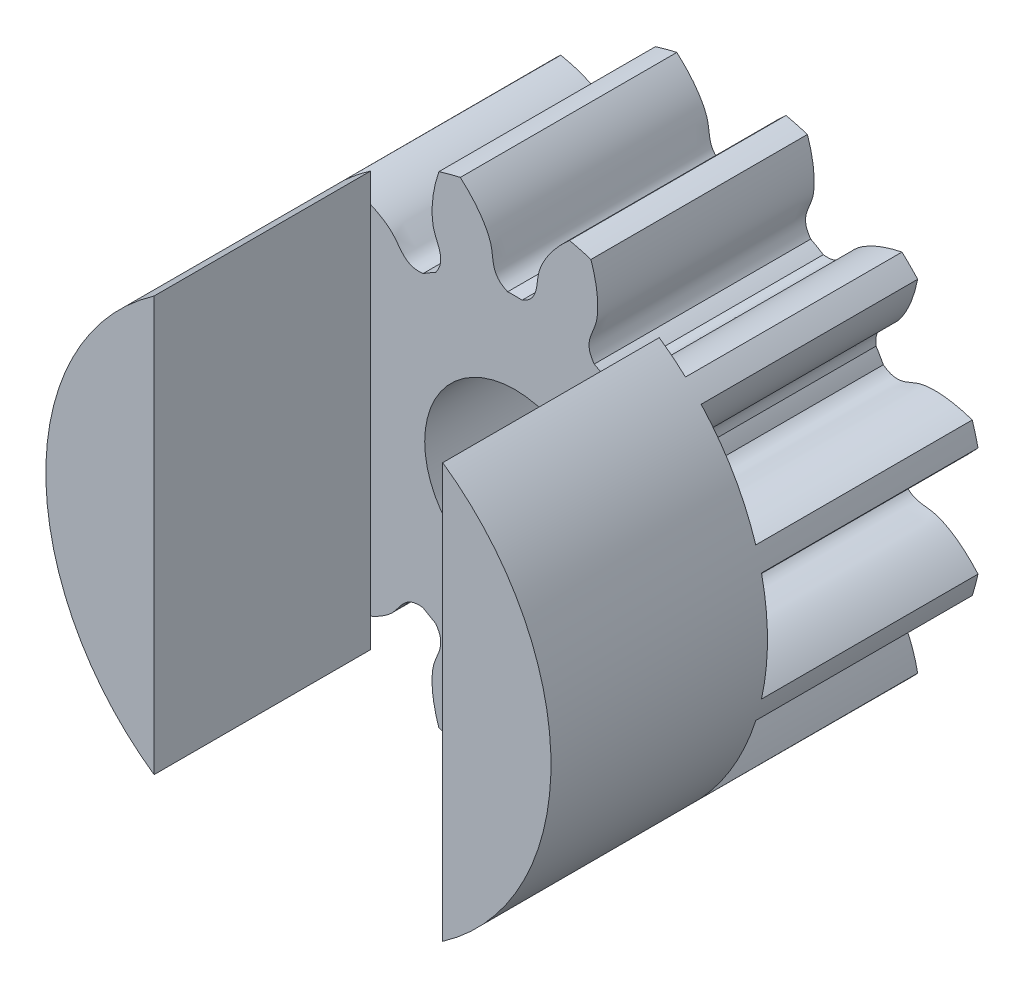
from build123d import *
from build123d.topology import SkipClean

# Parameters (mm, degrees)
SKETCH_1_R               = 35
EXTRUDE_1_DEPTH          = 30
CUT_EXTRUDE_1_DEPTH      = 58.879184514
PATTERN_CIRCULAR_1_COUNT = 12
SKETCH_4_R               = 1.348649371
EXTRUDE_2_DEPTH          = 30
SKETCH_6_R               = 35
EXTRUDE_3_DEPTH          = 30
SKETCH_7_W               = 40
SKETCH_7_H               = 80
CUT_EXTRUDE_3_DEPTH      = 30
SKETCH_8_R               = 12.5
CUT_EXTRUDE_4_DEPTH      = 60
SKETCH_9_W               = 106.659254736
SKETCH_9_H               = 73.466585518
CUT_EXTRUDE_5_DEPTH      = 30
SKETCH_10_R              = 3
CUT_EXTRUDE_6_DEPTH      = 20
PATTERN_CIRCULAR_2_COUNT = 4


with BuildPart() as part:
    # 草图1 → 凸台-拉伸1 (new body)
    with BuildSketch(Plane.XY):
        Circle(SKETCH_1_R)
    extrude(amount=EXTRUDE_1_DEPTH)

    # 草图2 → 切除-拉伸1 (cut, through all)
    with BuildSketch(Plane.XY):
        with BuildLine():
            ThreePointArc((1.004200563, 23.728760634), (0, 23.75), (-1.004200563, 23.728760634))
            add(Edge.make_bspline(
                [(-1.004200563, 23.728760634), (-3.403944346, 24.746537314), (-2.871867394, 26.724093412), (-3.38076094, 28.447402889), (-3.413119271, 28.549528686), (-3.451136253, 28.661667125), (-3.495214345, 28.783630438), (-3.545763126, 28.915216193), (-3.60318258, 29.056210344), (-3.667867805, 29.20638648), (-3.740207156, 29.365506261), (-3.820582386, 29.533319497), (-3.909368188, 29.709564356), (-4.006931927, 29.893967531), (-4.113633316, 30.086244436), (-4.229824121, 30.286099404), (-4.355847856, 30.493225893), (-4.492039492, 30.707306696), (-4.638725171, 30.928014167), (-4.796221921, 31.155010445), (-4.964837379, 31.387947689), (-5.144869519, 31.626468322), (-5.33660639, 31.870205277), (-5.540325852, 32.118782258), (-5.756295327, 32.371813994), (-5.984771551, 32.628906514), (-6.226000333, 32.889657418), (-6.480216324, 33.153656161), (-6.747642788, 33.420484335), (-7.028491386, 33.689715968), (-7.32296196, 33.960917814), (-7.631242333, 34.233649665), (-7.953508107, 34.507464654), (-8.289922475, 34.781909569), (-8.640636039, 35.056525175), (-9.005786639, 35.330846536), (-9.385499178, 35.604403341), (-9.779885473, 35.87672024), (-10.189044099, 36.147317177), (-10.61306025, 36.415709734), (-11.052005603, 36.68140947), (-11.505938195, 36.943924275), (-11.974902305, 37.202758718), (-12.458928347, 37.457414399), (-12.958032769, 37.707390312), (-13.472217963, 37.952183201), (-14.001472187, 38.191287921), (-14.545769481, 38.42419781), (-15.105069632, 38.650405046), (-15.679318024, 38.869401033), (-16.471898528, 39.153639794), (-17.077968001, 39.350507039), (-17.488027012, 39.474854551)],
                knots=[0, 0, 0, 0, 0.218015236, 0.222043642, 0.226545979, 0.231522246, 0.236972443, 0.24289657, 0.249294627, 0.256166614, 0.263512532, 0.271332379, 0.279626157, 0.288393865, 0.297635503, 0.307351072, 0.31754057, 0.328203999, 0.339341357, 0.350952646, 0.363037866, 0.375597015, 0.388630094, 0.402137104, 0.416118043, 0.430572913, 0.445501713, 0.460904444, 0.476781104, 0.493131694, 0.509956215, 0.527254666, 0.545027047, 0.563273358, 0.581993599, 0.601187771, 0.620855872, 0.640997904, 0.661613866, 0.682703758, 0.704267581, 0.726305333, 0.748817015, 0.771802628, 0.795262171, 0.819195644, 0.843603047, 0.868484381, 0.893839644, 0.919668838, 0.945971962, 1, 1, 1, 1], degree=3))
            ThreePointArc((-17.488027012, 39.474854551), (0, 43.175169144), (17.488027012, 39.474854551))
            add(Edge.make_bspline(
                [(1.004200563, 23.728760634), (3.403944346, 24.746537314), (2.871867394, 26.724093412), (3.38076094, 28.447402889), (3.413119271, 28.549528686), (3.451136253, 28.661667125), (3.495214345, 28.783630438), (3.545763126, 28.915216193), (3.60318258, 29.056210344), (3.667867805, 29.20638648), (3.740207156, 29.365506261), (3.820582386, 29.533319497), (3.909368188, 29.709564356), (4.006931927, 29.893967531), (4.113633316, 30.086244436), (4.229824121, 30.286099404), (4.355847856, 30.493225893), (4.492039492, 30.707306696), (4.638725171, 30.928014167), (4.796221921, 31.155010445), (4.964837379, 31.387947689), (5.144869519, 31.626468322), (5.33660639, 31.870205277), (5.540325852, 32.118782258), (5.756295327, 32.371813994), (5.984771551, 32.628906514), (6.226000333, 32.889657418), (6.480216324, 33.153656161), (6.747642788, 33.420484335), (7.028491386, 33.689715968), (7.32296196, 33.960917814), (7.631242333, 34.233649665), (7.953508107, 34.507464654), (8.289922475, 34.781909569), (8.640636039, 35.056525175), (9.005786639, 35.330846536), (9.385499178, 35.604403341), (9.779885473, 35.87672024), (10.189044099, 36.147317177), (10.61306025, 36.415709734), (11.052005603, 36.68140947), (11.505938195, 36.943924275), (11.974902305, 37.202758718), (12.458928347, 37.457414399), (12.958032769, 37.707390312), (13.472217963, 37.952183201), (14.001472187, 38.191287921), (14.545769481, 38.42419781), (15.105069632, 38.650405046), (15.679318024, 38.869401033), (16.471898528, 39.153639794), (17.077968001, 39.350507039), (17.488027012, 39.474854551)],
                knots=[0, 0, 0, 0, 0.218015236, 0.222043642, 0.226545979, 0.231522246, 0.236972443, 0.24289657, 0.249294627, 0.256166614, 0.263512532, 0.271332379, 0.279626157, 0.288393865, 0.297635503, 0.307351072, 0.31754057, 0.328203999, 0.339341357, 0.350952646, 0.363037866, 0.375597015, 0.388630094, 0.402137104, 0.416118043, 0.430572913, 0.445501713, 0.460904444, 0.476781104, 0.493131694, 0.509956215, 0.527254666, 0.545027047, 0.563273358, 0.581993599, 0.601187771, 0.620855872, 0.640997904, 0.661613866, 0.682703758, 0.704267581, 0.726305333, 0.748817015, 0.771802628, 0.795262171, 0.819195644, 0.843603047, 0.868484381, 0.893839644, 0.919668838, 0.945971962, 1, 1, 1, 1], degree=3))
        make_face()
    cut_extrude_1 = extrude(amount=CUT_EXTRUDE_1_DEPTH, mode=Mode.SUBTRACT)

    # 阵列(圆周)1: 切除-拉伸1 ×12 about axis
    pattern_circular_1_axis = Axis((0, 0, -1.5), (0, 0, 1))
    for i in range(1, PATTERN_CIRCULAR_1_COUNT):
        add(cut_extrude_1.rotate(pattern_circular_1_axis, i * 360 / PATTERN_CIRCULAR_1_COUNT), mode=Mode.SUBTRACT)

    # 草图4 → 凸台-拉伸2 (add)
    with BuildSketch(Plane.XY.offset(30)):
        with BuildLine():
            add(Edge.make_bspline(
                [(-7.56366055, 34.172957716), (-7.313833547, 33.954454925), (-7.067999618, 33.731381576), (-6.826371512, 33.503689643), (-6.589185463, 33.271331496), (-6.356702851, 33.034258297), (-6.129213225, 32.792416973), (-5.907040295, 32.545744134), (-5.527599606, 32.104781378), (-5.367880434, 31.912635747), (-5.211550318, 31.717683038), (-5.058790309, 31.519889276), (-4.909806319, 31.31922285), (-4.764833473, 31.115651439), (-4.624145715, 30.909134904), (-4.420033452, 30.594854303), (-4.353150963, 30.489345761), (-4.28746465, 30.383081115), (-4.223020035, 30.27605365), (-4.159867882, 30.168256646), (-4.098065387, 30.059682681), (-4.037677369, 29.950322927), (-3.919876468, 29.730007944), (-3.862468057, 29.61905764), (-3.806620329, 29.507301939), (-3.752427047, 29.394723479), (-3.699977335, 29.281316313), (-3.649406065, 29.167061917), (-3.600852533, 29.051948456), (-3.540189155, 28.900033561), (-3.526063655, 28.864041602), (-3.512158639, 28.827963338), (-3.498480168, 28.791798148), (-3.485035249, 28.755545314), (-3.471832712, 28.719203728), (-3.45888262, 28.682772053), (-3.440338037, 28.629392694), (-3.434537744, 28.612516623), (-3.428794545, 28.595620981), (-3.423109662, 28.578705612), (-3.417484344, 28.561770363), (-3.411919865, 28.544815079), (-3.406417524, 28.527839608), (-3.394633278, 28.491015298), (-3.388374533, 28.4711591), (-3.382203727, 28.451275212), (-3.376123245, 28.431363394), (-3.370136537, 28.411423151), (-3.364248127, 28.391453735), (-3.358463606, 28.371454147), (-3.322707472, 28.245223111), (-3.295710879, 28.138162365), (-3.271477245, 28.030426985), (-3.249663066, 27.92217802), (-3.229916641, 27.813548906), (-3.211885897, 27.704643853), (-3.195221354, 27.595537178), (-3.169383181, 27.415109839), (-3.159624576, 27.343885334), (-3.150202279, 27.272615193), (-3.141020991, 27.201313593), (-3.131985804, 27.129993825), (-3.123001775, 27.058668355), (-3.113973503, 26.987348869), (-3.08741659, 26.780825168), (-3.069528336, 26.645705905), (-3.050477966, 26.510722976), (-3.029601092, 26.375968626), (-3.00621509, 26.241595331), (-2.979617343, 26.107815825), (-2.949097562, 25.974900705), (-2.901136586, 25.795078651), (-2.887695412, 25.747147434), (-2.873608009, 25.699398314), (-2.858842512, 25.651851631), (-2.843368283, 25.604529604), (-2.827156372, 25.557456183), (-2.810179966, 25.510656899), (-2.756165729, 25.36928071), (-2.716623647, 25.27563233), (-2.673592255, 25.183473652), (-2.626919146, 25.093068671), (-2.576512156, 25.004676394), (-2.522353376, 24.918543333), (-2.464510878, 24.834897358), (-2.355927112, 24.691645283), (-2.306610899, 24.630927754), (-2.255267484, 24.57187846), (-2.201982731, 24.51455956), (-2.14685694, 24.459010566), (-2.090001365, 24.40525166), (-2.03153474, 24.353287003), (-1.863342054, 24.212519051), (-1.750267713, 24.127762264), (-1.633017345, 24.048726446), (-1.512238078, 23.975156988), (-1.388518749, 23.906726676), (-1.262359625, 23.84308378), (-1.134156697, 23.783877486), (-1.004200563, 23.728760634)],
                knots=[0.092462791, 0.092462791, 0.092462791, 0.092462791, 0.092462791, 0.092462791, 0.092462791, 0.092462791, 0.092462791, 0.280944946, 0.280944946, 0.280944946, 0.280944946, 0.280944946, 0.280944946, 0.280944946, 0.422817725, 0.422817725, 0.422817725, 0.422817725, 0.422817725, 0.422817725, 0.422817725, 0.493753763, 0.493753763, 0.493753763, 0.493753763, 0.493753763, 0.493753763, 0.493753763, 0.564691104, 0.564691104, 0.564691104, 0.564691104, 0.564691104, 0.564691104, 0.564691104, 0.58664773, 0.58664773, 0.58664773, 0.58664773, 0.58664773, 0.58664773, 0.58664773, 0.596781571, 0.596781571, 0.596781571, 0.596781571, 0.596781571, 0.596781571, 0.596781571, 0.608604416, 0.608604416, 0.608604416, 0.608604416, 0.608604416, 0.608604416, 0.608604416, 0.671286536, 0.671286536, 0.671286536, 0.671286536, 0.671286536, 0.671286536, 0.671286536, 0.712111621, 0.712111621, 0.712111621, 0.712111621, 0.712111621, 0.712111621, 0.712111621, 0.789534053, 0.789534053, 0.789534053, 0.789534053, 0.789534053, 0.789534053, 0.789534053, 0.817801835, 0.817801835, 0.817801835, 0.817801835, 0.817801835, 0.817801835, 0.817801835, 0.875481304, 0.875481304, 0.875481304, 0.875481304, 0.875481304, 0.875481304, 0.875481304, 0.919867959, 0.919867959, 0.919867959, 0.919867959, 0.919867959, 0.919867959, 0.919867959, 1, 1, 1, 1, 1, 1, 1, 1, 1], degree=8))
            ThreePointArc((-7.563660549, 34.172957717), (-9.058666579, 33.80740392), (-10.536156677, 33.37647978))
            add(Edge.make_bspline(
                [(-10.53615667, 33.376479777), (-10.653818539, 33.031374044), (-10.764548034, 32.683903922), (-10.868071148, 32.334149927), (-10.964082766, 31.982212957), (-11.052243651, 31.628213661), (-11.132174526, 31.272291005), (-11.203441899, 30.914598636), (-11.305539305, 30.323768044), (-11.341733453, 30.091586589), (-11.373976771, 29.858795806), (-11.402111335, 29.625451718), (-11.425969603, 29.391621802), (-11.445346952, 29.157387093), (-11.460021092, 28.922839003), (-11.474613618, 28.569213981), (-11.478240281, 28.450296998), (-11.480552585, 28.33134154), (-11.481510173, 28.212363405), (-11.481068941, 28.093380789), (-11.479180241, 27.974414261), (-11.475788635, 27.855486822), (-11.468347992, 27.677192795), (-11.465475998, 27.617777929), (-11.462203401, 27.558382807), (-11.458521911, 27.499010969), (-11.45442239, 27.43966633), (-11.449894324, 27.380353243), (-11.444926123, 27.321076436), (-11.434086403, 27.202605192), (-11.428213963, 27.143411264), (-11.42187827, 27.084263507), (-11.415063324, 27.02516821), (-11.407755464, 26.966131451), (-11.399938942, 26.907160213), (-11.3915917, 26.848263421), (-11.377354792, 26.754161367), (-11.371817812, 26.718903134), (-11.366075143, 26.683677462), (-11.360126237, 26.648485617), (-11.353962606, 26.613330675), (-11.347575312, 26.578215907), (-11.340962151, 26.5431433), (-11.327261432, 26.47309045), (-11.32017441, 26.438111044), (-11.312838551, 26.403181664), (-11.305259433, 26.368304793), (-11.297385331, 26.333491169), (-11.289279834, 26.298731991), (-11.280856319, 26.264049127), (-11.245062476, 26.122434486), (-11.214911838, 26.016218863), (-11.18203109, 25.910800471), (-11.146798241, 25.806147028), (-11.10958459, 25.702198242), (-11.070747146, 25.598868328), (-11.030625726, 25.496046904), (-10.96278857, 25.326873159), (-10.935627518, 25.260311625), (-10.908152396, 25.193878724), (-10.880452824, 25.127539083), (-10.852617642, 25.061256759), (-10.824735304, 24.994995075), (-10.796894274, 24.928716453), (-10.716631385, 24.736583225), (-10.664563435, 24.610622383), (-10.613570076, 24.484198553), (-10.564272804, 24.357059425), (-10.517339028, 24.228995738), (-10.4734836, 24.099840413), (-10.433456946, 23.969472653), (-10.385081342, 23.789761697), (-10.372756132, 23.741531459), (-10.36108162, 23.693135807), (-10.350095575, 23.644576422), (-10.339835636, 23.595857231), (-10.330338853, 23.546984497), (-10.321641209, 23.497966925), (-10.297730816, 23.348524435), (-10.285151074, 23.247651518), (-10.276338014, 23.146324066), (-10.271555621, 23.044694501), (-10.271013216, 22.942941049), (-10.274849565, 22.841268239), (-10.28311965, 22.739907451), (-10.305529914, 22.561555632), (-10.317880242, 22.484314603), (-10.332820297, 22.407504707), (-10.350306796, 22.331222707), (-10.370272635, 22.255552972), (-10.392631554, 22.180568606), (-10.417282808, 22.10633258), (-10.492557971, 21.900327615), (-10.548104829, 21.770388913), (-10.610128717, 21.643316703), (-10.677941902, 21.519214051), (-10.750870827, 21.398091997), (-10.828306387, 21.279896071), (-10.909730231, 21.164520452), (-10.994717119, 21.051809791)],
                knots=[0.062170162, 0.062170162, 0.062170162, 0.062170162, 0.062170162, 0.062170162, 0.062170162, 0.062170162, 0.062170162, 0.276143317, 0.276143317, 0.276143317, 0.276143317, 0.276143317, 0.276143317, 0.276143317, 0.414025254, 0.414025254, 0.414025254, 0.414025254, 0.414025254, 0.414025254, 0.414025254, 0.483838612, 0.483838612, 0.483838612, 0.483838612, 0.483838612, 0.483838612, 0.483838612, 0.518745235, 0.518745235, 0.518745235, 0.518745235, 0.518745235, 0.518745235, 0.518745235, 0.553651901, 0.553651901, 0.553651901, 0.553651901, 0.553651901, 0.553651901, 0.553651901, 0.574595891, 0.574595891, 0.574595891, 0.574595891, 0.574595891, 0.574595891, 0.574595891, 0.595540076, 0.595540076, 0.595540076, 0.595540076, 0.595540076, 0.595540076, 0.595540076, 0.660314454, 0.660314454, 0.660314454, 0.660314454, 0.660314454, 0.660314454, 0.660314454, 0.702502234, 0.702502234, 0.702502234, 0.702502234, 0.702502234, 0.702502234, 0.702502234, 0.78250894, 0.78250894, 0.78250894, 0.78250894, 0.78250894, 0.78250894, 0.78250894, 0.811720268, 0.811720268, 0.811720268, 0.811720268, 0.811720268, 0.811720268, 0.811720268, 0.871325012, 0.871325012, 0.871325012, 0.871325012, 0.871325012, 0.871325012, 0.871325012, 0.917193242, 0.917193242, 0.917193242, 0.917193242, 0.917193242, 0.917193242, 0.917193242, 1, 1, 1, 1, 1, 1, 1, 1, 1], degree=8))
            ThreePointArc((-10.994717119, 21.051809791), (-11.875, 20.56810334), (-12.734043515, 20.047609228))
            add(Edge.make_bspline(
                [(-23.636801039, 25.812819233), (-23.279098621, 25.742164321), (-22.92281722, 25.664323992), (-22.568161452, 25.579100968), (-22.215370009, 25.486281403), (-21.864716557, 25.385631314), (-21.516511489, 25.276891536), (-21.171105858, 25.159764259), (-20.675377486, 24.977411731), (-20.522504466, 24.919179224), (-20.370317323, 24.859154101), (-20.218857371, 24.797302103), (-20.068170078, 24.733586455), (-19.918305432, 24.667967031), (-19.769318319, 24.600399517), (-19.473218491, 24.461269178), (-19.326109293, 24.389707567), (-19.179999524, 24.316099504), (-19.034956081, 24.240390317), (-18.891057304, 24.162519114), (-18.748392342, 24.08241847), (-18.607062341, 24.000010798), (-18.37563487, 23.859681793), (-18.284706631, 23.8031382), (-18.194439151, 23.745535419), (-18.10486589, 23.68684914), (-18.01603942, 23.627036401), (-17.928002522, 23.566069376), (-17.840822281, 23.503894848), (-17.711440925, 23.408740748), (-17.668545731, 23.376707959), (-17.625894581, 23.344348754), (-17.583487986, 23.311668653), (-17.54135456, 23.278636244), (-17.499488564, 23.245266394), (-17.457917886, 23.211531242), (-17.396022641, 23.160370531), (-17.375467953, 23.143223909), (-17.354992655, 23.125982242), (-17.334598989, 23.108643804), (-17.314289328, 23.091206894), (-17.294066383, 23.073669576), (-17.273933404, 23.056029419), (-17.231628674, 23.018565136), (-17.209477759, 22.998717755), (-17.187450282, 22.978733139), (-17.165546906, 22.958611823), (-17.143770427, 22.938352688), (-17.122130095, 22.917948473), (-17.100640151, 22.897386965), (-17.000160635, 22.799727014), (-16.923250527, 22.720507984), (-16.848395895, 22.639323226), (-16.775379779, 22.556483961), (-16.703964316, 22.472281601), (-16.633896707, 22.386982431), (-16.564911452, 22.30082555), (-16.452321269, 22.157489977), (-16.408257816, 22.10068705), (-16.364462797, 22.043676445), (-16.320860769, 21.986518092), (-16.277376183, 21.929270955), (-16.233933051, 21.8719933), (-16.190454595, 21.81474295), (-16.064193783, 21.649166635), (-15.981142469, 21.541094047), (-15.8971529, 21.433720587), (-15.811695822, 21.327458333), (-15.724256303, 21.222780648), (-15.634332225, 21.12022307), (-15.54144376, 21.02037509), (-15.409997309, 20.888625111), (-15.374391302, 20.853836047), (-15.338316694, 20.819527797), (-15.301756056, 20.78573391), (-15.264693968, 20.752488947), (-15.22711733, 20.719828125), (-15.189015689, 20.687786958), (-15.071549893, 20.592358706), (-14.990481256, 20.53102787), (-14.907135638, 20.472731811), (-14.821513049, 20.417775355), (-14.733663178, 20.366428892), (-14.643693767, 20.318914863), (-14.551777707, 20.275396573), (-14.38611537, 20.205628521), (-14.313047512, 20.177703704), (-14.239058163, 20.152237224), (-14.164252764, 20.129239976), (-14.088737932, 20.108696032), (-14.012620106, 20.090567241), (-13.936004195, 20.07479784), (-13.71996108, 20.036985561), (-13.579657435, 20.0201212), (-13.438597729, 20.010299358), (-13.297215087, 20.006975973), (-13.155855848, 20.009573248), (-13.014777394, 20.017536446), (-12.874147255, 20.030363755), (-12.734043515, 20.047609228)],
                knots=[0.469943196, 0.469943196, 0.469943196, 0.469943196, 0.469943196, 0.469943196, 0.469943196, 0.469943196, 0.469943196, 0.59087995, 0.59087995, 0.59087995, 0.59087995, 0.59087995, 0.59087995, 0.59087995, 0.645134757, 0.645134757, 0.645134757, 0.645134757, 0.645134757, 0.645134757, 0.645134757, 0.699389917, 0.699389917, 0.699389917, 0.699389917, 0.699389917, 0.699389917, 0.699389917, 0.734902468, 0.734902468, 0.734902468, 0.734902468, 0.734902468, 0.734902468, 0.734902468, 0.752658702, 0.752658702, 0.752658702, 0.752658702, 0.752658702, 0.752658702, 0.752658702, 0.761536831, 0.761536831, 0.761536831, 0.761536831, 0.761536831, 0.761536831, 0.761536831, 0.771401476, 0.771401476, 0.771401476, 0.771401476, 0.771401476, 0.771401476, 0.771401476, 0.808011599, 0.808011599, 0.808011599, 0.808011599, 0.808011599, 0.808011599, 0.808011599, 0.8318559, 0.8318559, 0.8318559, 0.8318559, 0.8318559, 0.8318559, 0.8318559, 0.877075249, 0.877075249, 0.877075249, 0.877075249, 0.877075249, 0.877075249, 0.877075249, 0.893585331, 0.893585331, 0.893585331, 0.893585331, 0.893585331, 0.893585331, 0.893585331, 0.927273605, 0.927273605, 0.927273605, 0.927273605, 0.927273605, 0.927273605, 0.927273605, 0.953198076, 0.953198076, 0.953198076, 0.953198076, 0.953198076, 0.953198076, 0.953198076, 1, 1, 1, 1, 1, 1, 1, 1, 1], degree=8))
            ThreePointArc((-23.636801039, 25.81281923), (-24.748737342, 24.748737342), (-25.81281923, 23.636801039))
            add(Edge.make_bspline(
                [(-25.81281923, 23.636801039), (-25.737552788, 23.255752145), (-25.654134225, 22.876324799), (-25.562324198, 22.498757942), (-25.461860361, 22.123338575), (-25.352459747, 21.750400717), (-25.233796363, 21.38033343), (-25.105507417, 21.013577073), (-24.910962311, 20.503359972), (-24.853141328, 20.356707563), (-24.793628526, 20.210725026), (-24.732391504, 20.065451602), (-24.669395574, 19.920930462), (-24.604602859, 19.777209097), (-24.537971393, 19.634339719), (-24.400936596, 19.350418643), (-24.330535531, 19.209369872), (-24.258199477, 19.069290379), (-24.183884784, 18.930239974), (-24.107521597, 18.792299805), (-24.029058836, 18.655547154), (-23.948412149, 18.52008538), (-23.812298359, 18.300026661), (-23.758169309, 18.214606835), (-23.703081581, 18.129795496), (-23.64700514, 18.045630633), (-23.589914005, 17.962147418), (-23.531769543, 17.879397298), (-23.472534364, 17.797430505), (-23.381965962, 17.675755567), (-23.351490305, 17.635410537), (-23.320724362, 17.595285213), (-23.289657405, 17.555391508), (-23.258283874, 17.515738061), (-23.226597075, 17.476335046), (-23.19458307, 17.437198714), (-23.145106629, 17.377770649), (-23.127885666, 17.357278146), (-23.110568704, 17.336866396), (-23.093153978, 17.316537782), (-23.075639435, 17.296295047), (-23.05802274, 17.276141276), (-23.040301266, 17.256079884), (-23.004642852, 17.21614923), (-22.986705819, 17.19628055), (-22.968659018, 17.176511004), (-22.95050033, 17.156843673), (-22.932226752, 17.13728285), (-22.913833657, 17.117834612), (-22.895314056, 17.098507394), (-22.799727014, 17.000160635), (-22.720507984, 16.923250527), (-22.639323226, 16.848395895), (-22.556483961, 16.775379779), (-22.472281601, 16.703964316), (-22.386982431, 16.633896707), (-22.30082555, 16.564911452), (-22.157489977, 16.452321269), (-22.10068705, 16.408257816), (-22.043676445, 16.364462797), (-21.986518092, 16.320860769), (-21.929270955, 16.277376183), (-21.8719933, 16.233933051), (-21.81474295, 16.190454595), (-21.649166635, 16.064193783), (-21.541094047, 15.981142469), (-21.433720587, 15.8971529), (-21.327458333, 15.811695822), (-21.222780648, 15.724256303), (-21.12022307, 15.634332225), (-21.02037509, 15.54144376), (-20.888625111, 15.409997309), (-20.853836047, 15.374391302), (-20.819527797, 15.338316694), (-20.78573391, 15.301756056), (-20.752488947, 15.264693968), (-20.719828125, 15.22711733), (-20.687786958, 15.189015689), (-20.592358706, 15.071549893), (-20.53102787, 14.990481256), (-20.472731811, 14.907135638), (-20.417775355, 14.821513049), (-20.366428892, 14.733663178), (-20.318914863, 14.643693767), (-20.275396573, 14.551777707), (-20.205628521, 14.38611537), (-20.177703704, 14.313047512), (-20.152237224, 14.239058163), (-20.129239976, 14.164252764), (-20.108696032, 14.088737932), (-20.090567241, 14.012620106), (-20.07479784, 13.936004195), (-20.036985561, 13.71996108), (-20.0201212, 13.579657435), (-20.010299358, 13.438597729), (-20.006975973, 13.297215087), (-20.009573248, 13.155855848), (-20.017536446, 13.014777394), (-20.030363755, 12.874147255), (-20.047609228, 12.734043515)],
                knots=[0.4534802, 0.4534802, 0.4534802, 0.4534802, 0.4534802, 0.4534802, 0.4534802, 0.4534802, 0.4534802, 0.586310171, 0.586310171, 0.586310171, 0.586310171, 0.586310171, 0.586310171, 0.586310171, 0.640215998, 0.640215998, 0.640215998, 0.640215998, 0.640215998, 0.640215998, 0.640215998, 0.694122182, 0.694122182, 0.694122182, 0.694122182, 0.694122182, 0.694122182, 0.694122182, 0.728703563, 0.728703563, 0.728703563, 0.728703563, 0.728703563, 0.728703563, 0.728703563, 0.745994215, 0.745994215, 0.745994215, 0.745994215, 0.745994215, 0.745994215, 0.745994215, 0.755148085, 0.755148085, 0.755148085, 0.755148085, 0.755148085, 0.755148085, 0.755148085, 0.764301992, 0.764301992, 0.764301992, 0.764301992, 0.764301992, 0.764301992, 0.764301992, 0.802049099, 0.802049099, 0.802049099, 0.802049099, 0.802049099, 0.802049099, 0.802049099, 0.826633922, 0.826633922, 0.826633922, 0.826633922, 0.826633922, 0.826633922, 0.826633922, 0.873257629, 0.873257629, 0.873257629, 0.873257629, 0.873257629, 0.873257629, 0.873257629, 0.890280457, 0.890280457, 0.890280457, 0.890280457, 0.890280457, 0.890280457, 0.890280457, 0.925014973, 0.925014973, 0.925014973, 0.925014973, 0.925014973, 0.925014973, 0.925014973, 0.951744569, 0.951744569, 0.951744569, 0.951744569, 0.951744569, 0.951744569, 0.951744569, 1, 1, 1, 1, 1, 1, 1, 1, 1], degree=8))
            ThreePointArc((-20.047609228, 12.734043515), (-20.56810334, 11.875), (-21.051809791, 10.994717119))
            add(Edge.make_bspline(
                [(-33.37647978, 10.536156677), (-33.090484844, 10.633665048), (-32.802864231, 10.726413083), (-32.513668542, 10.814243106), (-32.222955565, 10.896984143), (-31.93078981, 10.974450241), (-31.637241772, 11.04643792), (-31.342386797, 11.112722341), (-30.789841408, 11.225297041), (-30.532478218, 11.27307226), (-30.274262074, 11.316205731), (-30.015258373, 11.354512224), (-29.755547966, 11.387781072), (-29.495226699, 11.41577404), (-29.234404102, 11.438216169), (-28.842599478, 11.463044451), (-28.71190621, 11.469847677), (-28.581136093, 11.475136397), (-28.450307254, 11.478863701), (-28.319440645, 11.480978243), (-28.188560027, 11.4814234), (-28.057691963, 11.480134802), (-27.861452798, 11.475486915), (-27.796050636, 11.473485443), (-27.730663033, 11.471022068), (-27.665294127, 11.46808666), (-27.599948467, 11.464668419), (-27.534631023, 11.460755612), (-27.469347188, 11.456335304), (-27.338858291, 11.446450884), (-27.2736538, 11.440985657), (-27.208493994, 11.434989054), (-27.143387729, 11.428430697), (-27.078338704, 11.421315286), (-27.013359237, 11.413601332), (-26.94845597, 11.405281123), (-26.842394771, 11.390621963), (-26.801184648, 11.384662445), (-26.760012512, 11.378440751), (-26.718882461, 11.37194452), (-26.677797485, 11.365167843), (-26.636760991, 11.358104298), (-26.595778338, 11.350739333), (-26.534391542, 11.339225823), (-26.513943786, 11.335310397), (-26.493511265, 11.331315635), (-26.473094738, 11.327239756), (-26.452694979, 11.323080935), (-26.432312782, 11.31883731), (-26.411948957, 11.314506977), (-26.371259667, 11.305668994), (-26.350934322, 11.301161127), (-26.330628968, 11.296563258), (-26.310344586, 11.291873201), (-26.290082475, 11.28708772), (-26.269844248, 11.282202524), (-26.249631836, 11.277212273), (-26.122434486, 11.245062476), (-26.016218863, 11.214911838), (-25.910800471, 11.18203109), (-25.806147028, 11.146798241), (-25.702198242, 11.10958459), (-25.598868328, 11.070747146), (-25.496046904, 11.030625726), (-25.326873159, 10.96278857), (-25.260311625, 10.935627518), (-25.193878724, 10.908152396), (-25.127539083, 10.880452824), (-25.061256759, 10.852617642), (-24.994995075, 10.824735304), (-24.928716453, 10.796894274), (-24.736583225, 10.716631385), (-24.610622383, 10.664563435), (-24.484198553, 10.613570076), (-24.357059425, 10.564272804), (-24.228995738, 10.517339028), (-24.099840413, 10.4734836), (-23.969472653, 10.433456946), (-23.789761697, 10.385081342), (-23.741531459, 10.372756132), (-23.693135807, 10.36108162), (-23.644576422, 10.350095575), (-23.595857231, 10.339835636), (-23.546984497, 10.330338853), (-23.497966925, 10.321641209), (-23.348524435, 10.297730816), (-23.247651518, 10.285151074), (-23.146324066, 10.276338014), (-23.044694501, 10.271555621), (-22.942941049, 10.271013216), (-22.841268239, 10.274849565), (-22.739907451, 10.28311965), (-22.561555632, 10.305529914), (-22.484314603, 10.317880242), (-22.407504707, 10.332820297), (-22.331222707, 10.350306796), (-22.255552972, 10.370272635), (-22.180568606, 10.392631554), (-22.10633258, 10.417282808), (-21.900327615, 10.492557971), (-21.770388913, 10.548104829), (-21.643316703, 10.610128717), (-21.519214051, 10.677941902), (-21.398091997, 10.750870827), (-21.279896071, 10.828306387), (-21.164520452, 10.909730231), (-21.051809791, 10.994717119)],
                knots=[0.119869387, 0.119869387, 0.119869387, 0.119869387, 0.119869387, 0.119869387, 0.119869387, 0.119869387, 0.119869387, 0.286281215, 0.286281215, 0.286281215, 0.286281215, 0.286281215, 0.286281215, 0.286281215, 0.430422587, 0.430422587, 0.430422587, 0.430422587, 0.430422587, 0.430422587, 0.430422587, 0.502492913, 0.502492913, 0.502492913, 0.502492913, 0.502492913, 0.502492913, 0.502492913, 0.538528018, 0.538528018, 0.538528018, 0.538528018, 0.538528018, 0.538528018, 0.538528018, 0.574563178, 0.574563178, 0.574563178, 0.574563178, 0.574563178, 0.574563178, 0.574563178, 0.597494642, 0.597494642, 0.597494642, 0.597494642, 0.597494642, 0.597494642, 0.597494642, 0.608960364, 0.608960364, 0.608960364, 0.608960364, 0.608960364, 0.608960364, 0.608960364, 0.620426112, 0.620426112, 0.620426112, 0.620426112, 0.620426112, 0.620426112, 0.620426112, 0.681214984, 0.681214984, 0.681214984, 0.681214984, 0.681214984, 0.681214984, 0.681214984, 0.72080699, 0.72080699, 0.72080699, 0.72080699, 0.72080699, 0.72080699, 0.72080699, 0.795890958, 0.795890958, 0.795890958, 0.795890958, 0.795890958, 0.795890958, 0.795890958, 0.823304941, 0.823304941, 0.823304941, 0.823304941, 0.823304941, 0.823304941, 0.823304941, 0.879242262, 0.879242262, 0.879242262, 0.879242262, 0.879242262, 0.879242262, 0.879242262, 0.922288264, 0.922288264, 0.922288264, 0.922288264, 0.922288264, 0.922288264, 0.922288264, 1, 1, 1, 1, 1, 1, 1, 1, 1], degree=8))
            ThreePointArc((-33.37647978, 10.536156677), (-33.80740392, 9.058666579), (-34.172957717, 7.563660549))
            add(Edge.make_bspline(
                [(-34.172957716, 7.56366055), (-33.954454925, 7.313833547), (-33.731381576, 7.067999618), (-33.503689643, 6.826371512), (-33.271331496, 6.589185463), (-33.034258297, 6.356702851), (-32.792416973, 6.129213225), (-32.545744134, 5.907040295), (-32.104781378, 5.527599606), (-31.912635747, 5.367880434), (-31.717683038, 5.211550318), (-31.519889276, 5.058790309), (-31.31922285, 4.909806319), (-31.115651439, 4.764833473), (-30.909134904, 4.624145715), (-30.594854303, 4.420033452), (-30.489345761, 4.353150963), (-30.383081115, 4.28746465), (-30.27605365, 4.223020035), (-30.168256646, 4.159867882), (-30.059682681, 4.098065387), (-29.950322927, 4.037677369), (-29.730007944, 3.919876468), (-29.61905764, 3.862468057), (-29.507301939, 3.806620329), (-29.394723479, 3.752427047), (-29.281316313, 3.699977335), (-29.167061917, 3.649406065), (-29.051948456, 3.600852533), (-28.900033561, 3.540189155), (-28.864041602, 3.526063655), (-28.827963338, 3.512158639), (-28.791798148, 3.498480168), (-28.755545314, 3.485035249), (-28.719203728, 3.471832712), (-28.682772053, 3.45888262), (-28.629392694, 3.440338037), (-28.612516623, 3.434537744), (-28.595620981, 3.428794545), (-28.578705612, 3.423109662), (-28.561770363, 3.417484344), (-28.544815079, 3.411919865), (-28.527839608, 3.406417524), (-28.491015298, 3.394633278), (-28.4711591, 3.388374533), (-28.451275212, 3.382203727), (-28.431363394, 3.376123245), (-28.411423151, 3.370136537), (-28.391453735, 3.364248127), (-28.371454147, 3.358463606), (-28.245223111, 3.322707472), (-28.138162365, 3.295710879), (-28.030426985, 3.271477245), (-27.92217802, 3.249663066), (-27.813548906, 3.229916641), (-27.704643853, 3.211885897), (-27.595537178, 3.195221354), (-27.415109839, 3.169383181), (-27.343885334, 3.159624576), (-27.272615193, 3.150202279), (-27.201313593, 3.141020991), (-27.129993825, 3.131985804), (-27.058668355, 3.123001775), (-26.987348869, 3.113973503), (-26.780825168, 3.08741659), (-26.645705905, 3.069528336), (-26.510722976, 3.050477966), (-26.375968626, 3.029601092), (-26.241595331, 3.00621509), (-26.107815825, 2.979617343), (-25.974900705, 2.949097562), (-25.795078651, 2.901136586), (-25.747147434, 2.887695412), (-25.699398314, 2.873608009), (-25.651851631, 2.858842512), (-25.604529604, 2.843368283), (-25.557456183, 2.827156372), (-25.510656899, 2.810179966), (-25.36928071, 2.756165729), (-25.27563233, 2.716623647), (-25.183473652, 2.673592255), (-25.093068671, 2.626919146), (-25.004676394, 2.576512156), (-24.918543333, 2.522353376), (-24.834897358, 2.464510878), (-24.691645283, 2.355927112), (-24.630927754, 2.306610899), (-24.57187846, 2.255267484), (-24.51455956, 2.201982731), (-24.459010566, 2.14685694), (-24.40525166, 2.090001365), (-24.353287003, 2.03153474), (-24.212519051, 1.863342054), (-24.127762264, 1.750267713), (-24.048726446, 1.633017345), (-23.975156988, 1.512238078), (-23.906726676, 1.388518749), (-23.84308378, 1.262359625), (-23.783877486, 1.134156697), (-23.728760634, 1.004200563)],
                knots=[0.092462791, 0.092462791, 0.092462791, 0.092462791, 0.092462791, 0.092462791, 0.092462791, 0.092462791, 0.092462791, 0.280944946, 0.280944946, 0.280944946, 0.280944946, 0.280944946, 0.280944946, 0.280944946, 0.422817725, 0.422817725, 0.422817725, 0.422817725, 0.422817725, 0.422817725, 0.422817725, 0.493753763, 0.493753763, 0.493753763, 0.493753763, 0.493753763, 0.493753763, 0.493753763, 0.564691104, 0.564691104, 0.564691104, 0.564691104, 0.564691104, 0.564691104, 0.564691104, 0.58664773, 0.58664773, 0.58664773, 0.58664773, 0.58664773, 0.58664773, 0.58664773, 0.596781571, 0.596781571, 0.596781571, 0.596781571, 0.596781571, 0.596781571, 0.596781571, 0.608604416, 0.608604416, 0.608604416, 0.608604416, 0.608604416, 0.608604416, 0.608604416, 0.671286536, 0.671286536, 0.671286536, 0.671286536, 0.671286536, 0.671286536, 0.671286536, 0.712111621, 0.712111621, 0.712111621, 0.712111621, 0.712111621, 0.712111621, 0.712111621, 0.789534053, 0.789534053, 0.789534053, 0.789534053, 0.789534053, 0.789534053, 0.789534053, 0.817801835, 0.817801835, 0.817801835, 0.817801835, 0.817801835, 0.817801835, 0.817801835, 0.875481304, 0.875481304, 0.875481304, 0.875481304, 0.875481304, 0.875481304, 0.875481304, 0.919867959, 0.919867959, 0.919867959, 0.919867959, 0.919867959, 0.919867959, 0.919867959, 1, 1, 1, 1, 1, 1, 1, 1, 1], degree=8))
            ThreePointArc((-23.728760634, 1.004200563), (-23.75, 0), (-23.728760634, -1.004200563))
            add(Edge.make_bspline(
                [(-34.172957716, -7.56366055), (-33.954454925, -7.313833547), (-33.731381576, -7.067999618), (-33.503689643, -6.826371512), (-33.271331496, -6.589185463), (-33.034258297, -6.356702851), (-32.792416973, -6.129213225), (-32.545744134, -5.907040295), (-32.104781378, -5.527599606), (-31.912635747, -5.367880434), (-31.717683038, -5.211550318), (-31.519889276, -5.058790309), (-31.31922285, -4.909806319), (-31.115651439, -4.764833473), (-30.909134904, -4.624145715), (-30.594854303, -4.420033452), (-30.489345761, -4.353150963), (-30.383081115, -4.28746465), (-30.27605365, -4.223020035), (-30.168256646, -4.159867882), (-30.059682681, -4.098065387), (-29.950322927, -4.037677369), (-29.730007944, -3.919876468), (-29.61905764, -3.862468057), (-29.507301939, -3.806620329), (-29.394723479, -3.752427047), (-29.281316313, -3.699977335), (-29.167061917, -3.649406065), (-29.051948456, -3.600852533), (-28.900033561, -3.540189155), (-28.864041602, -3.526063655), (-28.827963338, -3.512158639), (-28.791798148, -3.498480168), (-28.755545314, -3.485035249), (-28.719203728, -3.471832712), (-28.682772053, -3.45888262), (-28.629392694, -3.440338037), (-28.612516623, -3.434537744), (-28.595620981, -3.428794545), (-28.578705612, -3.423109662), (-28.561770363, -3.417484344), (-28.544815079, -3.411919865), (-28.527839608, -3.406417524), (-28.491015298, -3.394633278), (-28.4711591, -3.388374533), (-28.451275212, -3.382203727), (-28.431363394, -3.376123245), (-28.411423151, -3.370136537), (-28.391453735, -3.364248127), (-28.371454147, -3.358463606), (-28.245223111, -3.322707472), (-28.138162365, -3.295710879), (-28.030426985, -3.271477245), (-27.92217802, -3.249663066), (-27.813548906, -3.229916641), (-27.704643853, -3.211885897), (-27.595537178, -3.195221354), (-27.415109839, -3.169383181), (-27.343885334, -3.159624576), (-27.272615193, -3.150202279), (-27.201313593, -3.141020991), (-27.129993825, -3.131985804), (-27.058668355, -3.123001775), (-26.987348869, -3.113973503), (-26.780825168, -3.08741659), (-26.645705905, -3.069528336), (-26.510722976, -3.050477966), (-26.375968626, -3.029601092), (-26.241595331, -3.00621509), (-26.107815825, -2.979617343), (-25.974900705, -2.949097562), (-25.795078651, -2.901136586), (-25.747147434, -2.887695412), (-25.699398314, -2.873608009), (-25.651851631, -2.858842512), (-25.604529604, -2.843368283), (-25.557456183, -2.827156372), (-25.510656899, -2.810179966), (-25.36928071, -2.756165729), (-25.27563233, -2.716623647), (-25.183473652, -2.673592255), (-25.093068671, -2.626919146), (-25.004676394, -2.576512156), (-24.918543333, -2.522353376), (-24.834897358, -2.464510878), (-24.691645283, -2.355927112), (-24.630927754, -2.306610899), (-24.57187846, -2.255267484), (-24.51455956, -2.201982731), (-24.459010566, -2.14685694), (-24.40525166, -2.090001365), (-24.353287003, -2.03153474), (-24.212519051, -1.863342054), (-24.127762264, -1.750267713), (-24.048726446, -1.633017345), (-23.975156988, -1.512238078), (-23.906726676, -1.388518749), (-23.84308378, -1.262359625), (-23.783877486, -1.134156697), (-23.728760634, -1.004200563)],
                knots=[0.092462791, 0.092462791, 0.092462791, 0.092462791, 0.092462791, 0.092462791, 0.092462791, 0.092462791, 0.092462791, 0.280944946, 0.280944946, 0.280944946, 0.280944946, 0.280944946, 0.280944946, 0.280944946, 0.422817725, 0.422817725, 0.422817725, 0.422817725, 0.422817725, 0.422817725, 0.422817725, 0.493753763, 0.493753763, 0.493753763, 0.493753763, 0.493753763, 0.493753763, 0.493753763, 0.564691104, 0.564691104, 0.564691104, 0.564691104, 0.564691104, 0.564691104, 0.564691104, 0.58664773, 0.58664773, 0.58664773, 0.58664773, 0.58664773, 0.58664773, 0.58664773, 0.596781571, 0.596781571, 0.596781571, 0.596781571, 0.596781571, 0.596781571, 0.596781571, 0.608604416, 0.608604416, 0.608604416, 0.608604416, 0.608604416, 0.608604416, 0.608604416, 0.671286536, 0.671286536, 0.671286536, 0.671286536, 0.671286536, 0.671286536, 0.671286536, 0.712111621, 0.712111621, 0.712111621, 0.712111621, 0.712111621, 0.712111621, 0.712111621, 0.789534053, 0.789534053, 0.789534053, 0.789534053, 0.789534053, 0.789534053, 0.789534053, 0.817801835, 0.817801835, 0.817801835, 0.817801835, 0.817801835, 0.817801835, 0.817801835, 0.875481304, 0.875481304, 0.875481304, 0.875481304, 0.875481304, 0.875481304, 0.875481304, 0.919867959, 0.919867959, 0.919867959, 0.919867959, 0.919867959, 0.919867959, 0.919867959, 1, 1, 1, 1, 1, 1, 1, 1, 1], degree=8))
            ThreePointArc((-34.172957717, -7.563660549), (-33.80740392, -9.058666579), (-33.37647978, -10.536156677))
            add(Edge.make_bspline(
                [(-33.376479777, -10.53615667), (-33.031374044, -10.653818539), (-32.683903922, -10.764548034), (-32.334149927, -10.868071148), (-31.982212957, -10.964082766), (-31.628213661, -11.052243651), (-31.272291005, -11.132174526), (-30.914598636, -11.203441899), (-30.323768044, -11.305539305), (-30.091586589, -11.341733453), (-29.858795806, -11.373976771), (-29.625451718, -11.402111335), (-29.391621802, -11.425969603), (-29.157387093, -11.445346952), (-28.922839003, -11.460021092), (-28.569213981, -11.474613618), (-28.450296998, -11.478240281), (-28.33134154, -11.480552585), (-28.212363405, -11.481510173), (-28.093380789, -11.481068941), (-27.974414261, -11.479180241), (-27.855486822, -11.475788635), (-27.677192795, -11.468347992), (-27.617777929, -11.465475998), (-27.558382807, -11.462203401), (-27.499010969, -11.458521911), (-27.43966633, -11.45442239), (-27.380353243, -11.449894324), (-27.321076436, -11.444926123), (-27.202605192, -11.434086403), (-27.143411264, -11.428213963), (-27.084263507, -11.42187827), (-27.02516821, -11.415063324), (-26.966131451, -11.407755464), (-26.907160213, -11.399938942), (-26.848263421, -11.3915917), (-26.754161367, -11.377354792), (-26.718903134, -11.371817812), (-26.683677462, -11.366075143), (-26.648485617, -11.360126237), (-26.613330675, -11.353962606), (-26.578215907, -11.347575312), (-26.5431433, -11.340962151), (-26.47309045, -11.327261432), (-26.438111044, -11.32017441), (-26.403181664, -11.312838551), (-26.368304793, -11.305259433), (-26.333491169, -11.297385331), (-26.298731991, -11.289279834), (-26.264049127, -11.280856319), (-26.122434486, -11.245062476), (-26.016218863, -11.214911838), (-25.910800471, -11.18203109), (-25.806147028, -11.146798241), (-25.702198242, -11.10958459), (-25.598868328, -11.070747146), (-25.496046904, -11.030625726), (-25.326873159, -10.96278857), (-25.260311625, -10.935627518), (-25.193878724, -10.908152396), (-25.127539083, -10.880452824), (-25.061256759, -10.852617642), (-24.994995075, -10.824735304), (-24.928716453, -10.796894274), (-24.736583225, -10.716631385), (-24.610622383, -10.664563435), (-24.484198553, -10.613570076), (-24.357059425, -10.564272804), (-24.228995738, -10.517339028), (-24.099840413, -10.4734836), (-23.969472653, -10.433456946), (-23.789761697, -10.385081342), (-23.741531459, -10.372756132), (-23.693135807, -10.36108162), (-23.644576422, -10.350095575), (-23.595857231, -10.339835636), (-23.546984497, -10.330338853), (-23.497966925, -10.321641209), (-23.348524435, -10.297730816), (-23.247651518, -10.285151074), (-23.146324066, -10.276338014), (-23.044694501, -10.271555621), (-22.942941049, -10.271013216), (-22.841268239, -10.274849565), (-22.739907451, -10.28311965), (-22.561555632, -10.305529914), (-22.484314603, -10.317880242), (-22.407504707, -10.332820297), (-22.331222707, -10.350306796), (-22.255552972, -10.370272635), (-22.180568606, -10.392631554), (-22.10633258, -10.417282808), (-21.900327615, -10.492557971), (-21.770388913, -10.548104829), (-21.643316703, -10.610128717), (-21.519214051, -10.677941902), (-21.398091997, -10.750870827), (-21.279896071, -10.828306387), (-21.164520452, -10.909730231), (-21.051809791, -10.994717119)],
                knots=[0.062170162, 0.062170162, 0.062170162, 0.062170162, 0.062170162, 0.062170162, 0.062170162, 0.062170162, 0.062170162, 0.276143317, 0.276143317, 0.276143317, 0.276143317, 0.276143317, 0.276143317, 0.276143317, 0.414025254, 0.414025254, 0.414025254, 0.414025254, 0.414025254, 0.414025254, 0.414025254, 0.483838612, 0.483838612, 0.483838612, 0.483838612, 0.483838612, 0.483838612, 0.483838612, 0.518745235, 0.518745235, 0.518745235, 0.518745235, 0.518745235, 0.518745235, 0.518745235, 0.553651901, 0.553651901, 0.553651901, 0.553651901, 0.553651901, 0.553651901, 0.553651901, 0.574595891, 0.574595891, 0.574595891, 0.574595891, 0.574595891, 0.574595891, 0.574595891, 0.595540076, 0.595540076, 0.595540076, 0.595540076, 0.595540076, 0.595540076, 0.595540076, 0.660314454, 0.660314454, 0.660314454, 0.660314454, 0.660314454, 0.660314454, 0.660314454, 0.702502235, 0.702502235, 0.702502235, 0.702502235, 0.702502235, 0.702502235, 0.702502235, 0.78250894, 0.78250894, 0.78250894, 0.78250894, 0.78250894, 0.78250894, 0.78250894, 0.811720268, 0.811720268, 0.811720268, 0.811720268, 0.811720268, 0.811720268, 0.811720268, 0.871325012, 0.871325012, 0.871325012, 0.871325012, 0.871325012, 0.871325012, 0.871325012, 0.917193242, 0.917193242, 0.917193242, 0.917193242, 0.917193242, 0.917193242, 0.917193242, 1, 1, 1, 1, 1, 1, 1, 1, 1], degree=8))
            ThreePointArc((-21.051809791, -10.994717119), (-20.56810334, -11.875), (-20.047609228, -12.734043515))
            add(Edge.make_bspline(
                [(-25.812819233, -23.636801039), (-25.742164321, -23.279098621), (-25.664323992, -22.92281722), (-25.579100968, -22.568161452), (-25.486281403, -22.215370009), (-25.385631314, -21.864716557), (-25.276891536, -21.516511489), (-25.159764259, -21.171105858), (-24.977411731, -20.675377486), (-24.919179224, -20.522504466), (-24.859154101, -20.370317323), (-24.797302103, -20.218857371), (-24.733586455, -20.068170078), (-24.667967031, -19.918305432), (-24.600399517, -19.769318319), (-24.461269178, -19.473218491), (-24.389707567, -19.326109293), (-24.316099504, -19.179999524), (-24.240390317, -19.034956081), (-24.162519114, -18.891057304), (-24.08241847, -18.748392342), (-24.000010798, -18.607062341), (-23.859681793, -18.37563487), (-23.8031382, -18.284706631), (-23.745535419, -18.194439151), (-23.68684914, -18.10486589), (-23.627036401, -18.01603942), (-23.566069376, -17.928002522), (-23.503894848, -17.840822281), (-23.408740748, -17.711440925), (-23.376707959, -17.668545731), (-23.344348754, -17.625894581), (-23.311668653, -17.583487986), (-23.278636244, -17.54135456), (-23.245266394, -17.499488564), (-23.211531242, -17.457917886), (-23.160370531, -17.396022641), (-23.143223909, -17.375467953), (-23.125982242, -17.354992655), (-23.108643804, -17.334598989), (-23.091206894, -17.314289328), (-23.073669576, -17.294066383), (-23.056029419, -17.273933404), (-23.018565136, -17.231628674), (-22.998717755, -17.209477759), (-22.978733139, -17.187450282), (-22.958611823, -17.165546906), (-22.938352688, -17.143770427), (-22.917948473, -17.122130095), (-22.897386965, -17.100640151), (-22.799727014, -17.000160635), (-22.720507984, -16.923250527), (-22.639323226, -16.848395895), (-22.556483961, -16.775379779), (-22.472281601, -16.703964316), (-22.386982431, -16.633896707), (-22.30082555, -16.564911452), (-22.157489977, -16.452321269), (-22.10068705, -16.408257816), (-22.043676445, -16.364462797), (-21.986518092, -16.320860769), (-21.929270955, -16.277376183), (-21.8719933, -16.233933051), (-21.81474295, -16.190454595), (-21.649166635, -16.064193783), (-21.541094047, -15.981142469), (-21.433720587, -15.8971529), (-21.327458333, -15.811695822), (-21.222780648, -15.724256303), (-21.12022307, -15.634332225), (-21.02037509, -15.54144376), (-20.888625111, -15.409997309), (-20.853836047, -15.374391302), (-20.819527797, -15.338316694), (-20.78573391, -15.301756056), (-20.752488947, -15.264693968), (-20.719828125, -15.22711733), (-20.687786958, -15.189015689), (-20.592358706, -15.071549893), (-20.53102787, -14.990481256), (-20.472731811, -14.907135638), (-20.417775355, -14.821513049), (-20.366428892, -14.733663178), (-20.318914863, -14.643693767), (-20.275396573, -14.551777707), (-20.205628521, -14.38611537), (-20.177703704, -14.313047512), (-20.152237224, -14.239058163), (-20.129239976, -14.164252764), (-20.108696032, -14.088737932), (-20.090567241, -14.012620106), (-20.07479784, -13.936004195), (-20.036985561, -13.71996108), (-20.0201212, -13.579657435), (-20.010299358, -13.438597729), (-20.006975973, -13.297215087), (-20.009573248, -13.155855848), (-20.017536446, -13.014777394), (-20.030363755, -12.874147255), (-20.047609228, -12.734043515)],
                knots=[0.469943196, 0.469943196, 0.469943196, 0.469943196, 0.469943196, 0.469943196, 0.469943196, 0.469943196, 0.469943196, 0.59087995, 0.59087995, 0.59087995, 0.59087995, 0.59087995, 0.59087995, 0.59087995, 0.645134757, 0.645134757, 0.645134757, 0.645134757, 0.645134757, 0.645134757, 0.645134757, 0.699389917, 0.699389917, 0.699389917, 0.699389917, 0.699389917, 0.699389917, 0.699389917, 0.734902468, 0.734902468, 0.734902468, 0.734902468, 0.734902468, 0.734902468, 0.734902468, 0.752658702, 0.752658702, 0.752658702, 0.752658702, 0.752658702, 0.752658702, 0.752658702, 0.761536831, 0.761536831, 0.761536831, 0.761536831, 0.761536831, 0.761536831, 0.761536831, 0.771401476, 0.771401476, 0.771401476, 0.771401476, 0.771401476, 0.771401476, 0.771401476, 0.808011599, 0.808011599, 0.808011599, 0.808011599, 0.808011599, 0.808011599, 0.808011599, 0.8318559, 0.8318559, 0.8318559, 0.8318559, 0.8318559, 0.8318559, 0.8318559, 0.877075249, 0.877075249, 0.877075249, 0.877075249, 0.877075249, 0.877075249, 0.877075249, 0.893585331, 0.893585331, 0.893585331, 0.893585331, 0.893585331, 0.893585331, 0.893585331, 0.927273605, 0.927273605, 0.927273605, 0.927273605, 0.927273605, 0.927273605, 0.927273605, 0.953198076, 0.953198076, 0.953198076, 0.953198076, 0.953198076, 0.953198076, 0.953198076, 1, 1, 1, 1, 1, 1, 1, 1, 1], degree=8))
            ThreePointArc((-25.81281923, -23.636801039), (-24.748737342, -24.748737342), (-23.636801039, -25.81281923))
            add(Edge.make_bspline(
                [(-23.636801039, -25.81281923), (-23.255752145, -25.737552788), (-22.876324799, -25.654134225), (-22.498757942, -25.562324198), (-22.123338575, -25.461860361), (-21.750400717, -25.352459747), (-21.38033343, -25.233796363), (-21.013577073, -25.105507417), (-20.503359972, -24.910962311), (-20.356707563, -24.853141328), (-20.210725026, -24.793628526), (-20.065451602, -24.732391504), (-19.920930462, -24.669395574), (-19.777209097, -24.604602859), (-19.634339719, -24.537971393), (-19.350418643, -24.400936596), (-19.209369872, -24.330535531), (-19.069290379, -24.258199477), (-18.930239974, -24.183884784), (-18.792299805, -24.107521597), (-18.655547154, -24.029058836), (-18.52008538, -23.948412149), (-18.300026661, -23.812298359), (-18.214606835, -23.758169309), (-18.129795496, -23.703081581), (-18.045630633, -23.64700514), (-17.962147418, -23.589914005), (-17.879397298, -23.531769543), (-17.797430505, -23.472534364), (-17.675755567, -23.381965962), (-17.635410537, -23.351490305), (-17.595285213, -23.320724362), (-17.555391508, -23.289657405), (-17.515738061, -23.258283874), (-17.476335046, -23.226597075), (-17.437198714, -23.19458307), (-17.377770649, -23.145106629), (-17.357278146, -23.127885666), (-17.336866396, -23.110568704), (-17.316537782, -23.093153978), (-17.296295047, -23.075639435), (-17.276141276, -23.05802274), (-17.256079884, -23.040301266), (-17.21614923, -23.004642852), (-17.19628055, -22.986705819), (-17.176511004, -22.968659018), (-17.156843673, -22.95050033), (-17.13728285, -22.932226752), (-17.117834612, -22.913833657), (-17.098507394, -22.895314056), (-17.000160635, -22.799727014), (-16.923250527, -22.720507984), (-16.848395895, -22.639323226), (-16.775379779, -22.556483961), (-16.703964316, -22.472281601), (-16.633896707, -22.386982431), (-16.564911452, -22.30082555), (-16.452321269, -22.157489977), (-16.408257816, -22.10068705), (-16.364462797, -22.043676445), (-16.320860769, -21.986518092), (-16.277376183, -21.929270955), (-16.233933051, -21.8719933), (-16.190454595, -21.81474295), (-16.064193783, -21.649166635), (-15.981142469, -21.541094047), (-15.8971529, -21.433720587), (-15.811695822, -21.327458333), (-15.724256303, -21.222780648), (-15.634332225, -21.12022307), (-15.54144376, -21.02037509), (-15.409997309, -20.888625111), (-15.374391302, -20.853836047), (-15.338316694, -20.819527797), (-15.301756056, -20.78573391), (-15.264693968, -20.752488947), (-15.22711733, -20.719828125), (-15.189015689, -20.687786958), (-15.071549893, -20.592358706), (-14.990481256, -20.53102787), (-14.907135638, -20.472731811), (-14.821513049, -20.417775355), (-14.733663178, -20.366428892), (-14.643693767, -20.318914863), (-14.551777707, -20.275396573), (-14.38611537, -20.205628521), (-14.313047512, -20.177703704), (-14.239058163, -20.152237224), (-14.164252764, -20.129239976), (-14.088737932, -20.108696032), (-14.012620106, -20.090567241), (-13.936004195, -20.07479784), (-13.71996108, -20.036985561), (-13.579657435, -20.0201212), (-13.438597729, -20.010299358), (-13.297215087, -20.006975973), (-13.155855848, -20.009573248), (-13.014777394, -20.017536446), (-12.874147255, -20.030363755), (-12.734043515, -20.047609228)],
                knots=[0.4534802, 0.4534802, 0.4534802, 0.4534802, 0.4534802, 0.4534802, 0.4534802, 0.4534802, 0.4534802, 0.586310171, 0.586310171, 0.586310171, 0.586310171, 0.586310171, 0.586310171, 0.586310171, 0.640215998, 0.640215998, 0.640215998, 0.640215998, 0.640215998, 0.640215998, 0.640215998, 0.694122182, 0.694122182, 0.694122182, 0.694122182, 0.694122182, 0.694122182, 0.694122182, 0.728703563, 0.728703563, 0.728703563, 0.728703563, 0.728703563, 0.728703563, 0.728703563, 0.745994215, 0.745994215, 0.745994215, 0.745994215, 0.745994215, 0.745994215, 0.745994215, 0.755148085, 0.755148085, 0.755148085, 0.755148085, 0.755148085, 0.755148085, 0.755148085, 0.764301992, 0.764301992, 0.764301992, 0.764301992, 0.764301992, 0.764301992, 0.764301992, 0.802049099, 0.802049099, 0.802049099, 0.802049099, 0.802049099, 0.802049099, 0.802049099, 0.826633922, 0.826633922, 0.826633922, 0.826633922, 0.826633922, 0.826633922, 0.826633922, 0.873257629, 0.873257629, 0.873257629, 0.873257629, 0.873257629, 0.873257629, 0.873257629, 0.890280457, 0.890280457, 0.890280457, 0.890280457, 0.890280457, 0.890280457, 0.890280457, 0.925014973, 0.925014973, 0.925014973, 0.925014973, 0.925014973, 0.925014973, 0.925014973, 0.951744569, 0.951744569, 0.951744569, 0.951744569, 0.951744569, 0.951744569, 0.951744569, 1, 1, 1, 1, 1, 1, 1, 1, 1], degree=8))
            ThreePointArc((-12.734043515, -20.047609228), (-11.875, -20.56810334), (-10.994717119, -21.051809791))
            add(Edge.make_bspline(
                [(-10.536156677, -33.37647978), (-10.633665048, -33.090484844), (-10.726413083, -32.802864231), (-10.814243106, -32.513668542), (-10.896984143, -32.222955565), (-10.974450241, -31.93078981), (-11.04643792, -31.637241772), (-11.112722341, -31.342386797), (-11.225297041, -30.789841408), (-11.27307226, -30.532478218), (-11.316205731, -30.274262074), (-11.354512224, -30.015258373), (-11.387781072, -29.755547966), (-11.41577404, -29.495226699), (-11.438216169, -29.234404102), (-11.463044451, -28.842599478), (-11.469847677, -28.71190621), (-11.475136397, -28.581136093), (-11.478863701, -28.450307254), (-11.480978243, -28.319440645), (-11.4814234, -28.188560027), (-11.480134802, -28.057691963), (-11.475486915, -27.861452798), (-11.473485443, -27.796050636), (-11.471022068, -27.730663033), (-11.46808666, -27.665294127), (-11.464668419, -27.599948467), (-11.460755612, -27.534631023), (-11.456335304, -27.469347188), (-11.446450884, -27.338858291), (-11.440985657, -27.2736538), (-11.434989054, -27.208493994), (-11.428430697, -27.143387729), (-11.421315286, -27.078338704), (-11.413601332, -27.013359237), (-11.405281123, -26.94845597), (-11.390621963, -26.842394771), (-11.384662445, -26.801184648), (-11.378440751, -26.760012512), (-11.37194452, -26.718882461), (-11.365167843, -26.677797485), (-11.358104298, -26.636760991), (-11.350739333, -26.595778338), (-11.339225823, -26.534391542), (-11.335310397, -26.513943786), (-11.331315635, -26.493511265), (-11.327239756, -26.473094738), (-11.323080935, -26.452694979), (-11.31883731, -26.432312782), (-11.314506977, -26.411948957), (-11.305668994, -26.371259667), (-11.301161127, -26.350934322), (-11.296563258, -26.330628968), (-11.291873201, -26.310344586), (-11.28708772, -26.290082475), (-11.282202524, -26.269844248), (-11.277212273, -26.249631836), (-11.245062476, -26.122434486), (-11.214911838, -26.016218863), (-11.18203109, -25.910800471), (-11.146798241, -25.806147028), (-11.10958459, -25.702198242), (-11.070747146, -25.598868328), (-11.030625726, -25.496046904), (-10.96278857, -25.326873159), (-10.935627518, -25.260311625), (-10.908152396, -25.193878724), (-10.880452824, -25.127539083), (-10.852617642, -25.061256759), (-10.824735304, -24.994995075), (-10.796894274, -24.928716453), (-10.716631385, -24.736583225), (-10.664563435, -24.610622383), (-10.613570076, -24.484198553), (-10.564272804, -24.357059425), (-10.517339028, -24.228995738), (-10.4734836, -24.099840413), (-10.433456946, -23.969472653), (-10.385081342, -23.789761697), (-10.372756132, -23.741531459), (-10.36108162, -23.693135807), (-10.350095575, -23.644576422), (-10.339835636, -23.595857231), (-10.330338853, -23.546984497), (-10.321641209, -23.497966925), (-10.297730816, -23.348524435), (-10.285151074, -23.247651518), (-10.276338014, -23.146324066), (-10.271555621, -23.044694501), (-10.271013216, -22.942941049), (-10.274849565, -22.841268239), (-10.28311965, -22.739907451), (-10.305529914, -22.561555632), (-10.317880242, -22.484314603), (-10.332820297, -22.407504707), (-10.350306796, -22.331222707), (-10.370272635, -22.255552972), (-10.392631554, -22.180568606), (-10.417282808, -22.10633258), (-10.492557971, -21.900327615), (-10.548104829, -21.770388913), (-10.610128717, -21.643316703), (-10.677941902, -21.519214051), (-10.750870827, -21.398091997), (-10.828306387, -21.279896071), (-10.909730231, -21.164520452), (-10.994717119, -21.051809791)],
                knots=[0.119869387, 0.119869387, 0.119869387, 0.119869387, 0.119869387, 0.119869387, 0.119869387, 0.119869387, 0.119869387, 0.286281215, 0.286281215, 0.286281215, 0.286281215, 0.286281215, 0.286281215, 0.286281215, 0.430422587, 0.430422587, 0.430422587, 0.430422587, 0.430422587, 0.430422587, 0.430422587, 0.502492913, 0.502492913, 0.502492913, 0.502492913, 0.502492913, 0.502492913, 0.502492913, 0.538528018, 0.538528018, 0.538528018, 0.538528018, 0.538528018, 0.538528018, 0.538528018, 0.574563178, 0.574563178, 0.574563178, 0.574563178, 0.574563178, 0.574563178, 0.574563178, 0.597494642, 0.597494642, 0.597494642, 0.597494642, 0.597494642, 0.597494642, 0.597494642, 0.608960364, 0.608960364, 0.608960364, 0.608960364, 0.608960364, 0.608960364, 0.608960364, 0.620426112, 0.620426112, 0.620426112, 0.620426112, 0.620426112, 0.620426112, 0.620426112, 0.681214984, 0.681214984, 0.681214984, 0.681214984, 0.681214984, 0.681214984, 0.681214984, 0.72080699, 0.72080699, 0.72080699, 0.72080699, 0.72080699, 0.72080699, 0.72080699, 0.795890958, 0.795890958, 0.795890958, 0.795890958, 0.795890958, 0.795890958, 0.795890958, 0.823304941, 0.823304941, 0.823304941, 0.823304941, 0.823304941, 0.823304941, 0.823304941, 0.879242262, 0.879242262, 0.879242262, 0.879242262, 0.879242262, 0.879242262, 0.879242262, 0.922288264, 0.922288264, 0.922288264, 0.922288264, 0.922288264, 0.922288264, 0.922288264, 1, 1, 1, 1, 1, 1, 1, 1, 1], degree=8))
            ThreePointArc((-10.536156677, -33.37647978), (-9.058666579, -33.80740392), (-7.563660549, -34.172957717))
            add(Edge.make_bspline(
                [(-7.56366055, -34.172957716), (-7.313833547, -33.954454925), (-7.067999618, -33.731381576), (-6.826371512, -33.503689643), (-6.589185463, -33.271331496), (-6.356702851, -33.034258297), (-6.129213225, -32.792416973), (-5.907040295, -32.545744134), (-5.527599606, -32.104781378), (-5.367880434, -31.912635747), (-5.211550318, -31.717683038), (-5.058790309, -31.519889276), (-4.909806319, -31.31922285), (-4.764833473, -31.115651439), (-4.624145715, -30.909134904), (-4.420033452, -30.594854303), (-4.353150963, -30.489345761), (-4.28746465, -30.383081115), (-4.223020035, -30.27605365), (-4.159867882, -30.168256646), (-4.098065387, -30.059682681), (-4.037677369, -29.950322927), (-3.919876468, -29.730007944), (-3.862468057, -29.61905764), (-3.806620329, -29.507301939), (-3.752427047, -29.394723479), (-3.699977335, -29.281316313), (-3.649406065, -29.167061917), (-3.600852533, -29.051948456), (-3.540189155, -28.900033561), (-3.526063655, -28.864041602), (-3.512158639, -28.827963338), (-3.498480168, -28.791798148), (-3.485035249, -28.755545314), (-3.471832712, -28.719203728), (-3.45888262, -28.682772053), (-3.440338037, -28.629392694), (-3.434537744, -28.612516623), (-3.428794545, -28.595620981), (-3.423109662, -28.578705612), (-3.417484344, -28.561770363), (-3.411919865, -28.544815079), (-3.406417524, -28.527839608), (-3.394633278, -28.491015298), (-3.388374533, -28.4711591), (-3.382203727, -28.451275212), (-3.376123245, -28.431363394), (-3.370136537, -28.411423151), (-3.364248127, -28.391453735), (-3.358463606, -28.371454147), (-3.322707472, -28.245223111), (-3.295710879, -28.138162365), (-3.271477245, -28.030426985), (-3.249663066, -27.92217802), (-3.229916641, -27.813548906), (-3.211885897, -27.704643853), (-3.195221354, -27.595537178), (-3.169383181, -27.415109839), (-3.159624576, -27.343885334), (-3.150202279, -27.272615193), (-3.141020991, -27.201313593), (-3.131985804, -27.129993825), (-3.123001775, -27.058668355), (-3.113973503, -26.987348869), (-3.08741659, -26.780825168), (-3.069528336, -26.645705905), (-3.050477966, -26.510722976), (-3.029601092, -26.375968626), (-3.00621509, -26.241595331), (-2.979617343, -26.107815825), (-2.949097562, -25.974900705), (-2.901136586, -25.795078651), (-2.887695412, -25.747147434), (-2.873608009, -25.699398314), (-2.858842512, -25.651851631), (-2.843368283, -25.604529604), (-2.827156372, -25.557456183), (-2.810179966, -25.510656899), (-2.756165729, -25.36928071), (-2.716623647, -25.27563233), (-2.673592255, -25.183473652), (-2.626919146, -25.093068671), (-2.576512156, -25.004676394), (-2.522353376, -24.918543333), (-2.464510878, -24.834897358), (-2.355927112, -24.691645283), (-2.306610899, -24.630927754), (-2.255267484, -24.57187846), (-2.201982731, -24.51455956), (-2.14685694, -24.459010566), (-2.090001365, -24.40525166), (-2.03153474, -24.353287003), (-1.863342054, -24.212519051), (-1.750267713, -24.127762264), (-1.633017345, -24.048726446), (-1.512238078, -23.975156988), (-1.388518749, -23.906726676), (-1.262359625, -23.84308378), (-1.134156697, -23.783877486), (-1.004200563, -23.728760634)],
                knots=[0.092462791, 0.092462791, 0.092462791, 0.092462791, 0.092462791, 0.092462791, 0.092462791, 0.092462791, 0.092462791, 0.280944946, 0.280944946, 0.280944946, 0.280944946, 0.280944946, 0.280944946, 0.280944946, 0.422817725, 0.422817725, 0.422817725, 0.422817725, 0.422817725, 0.422817725, 0.422817725, 0.493753763, 0.493753763, 0.493753763, 0.493753763, 0.493753763, 0.493753763, 0.493753763, 0.564691104, 0.564691104, 0.564691104, 0.564691104, 0.564691104, 0.564691104, 0.564691104, 0.58664773, 0.58664773, 0.58664773, 0.58664773, 0.58664773, 0.58664773, 0.58664773, 0.596781571, 0.596781571, 0.596781571, 0.596781571, 0.596781571, 0.596781571, 0.596781571, 0.608604416, 0.608604416, 0.608604416, 0.608604416, 0.608604416, 0.608604416, 0.608604416, 0.671286536, 0.671286536, 0.671286536, 0.671286536, 0.671286536, 0.671286536, 0.671286536, 0.712111621, 0.712111621, 0.712111621, 0.712111621, 0.712111621, 0.712111621, 0.712111621, 0.789534053, 0.789534053, 0.789534053, 0.789534053, 0.789534053, 0.789534053, 0.789534053, 0.817801835, 0.817801835, 0.817801835, 0.817801835, 0.817801835, 0.817801835, 0.817801835, 0.875481304, 0.875481304, 0.875481304, 0.875481304, 0.875481304, 0.875481304, 0.875481304, 0.919867959, 0.919867959, 0.919867959, 0.919867959, 0.919867959, 0.919867959, 0.919867959, 1, 1, 1, 1, 1, 1, 1, 1, 1], degree=8))
            ThreePointArc((-1.004200563, -23.728760634), (0, -23.75), (1.004200563, -23.728760634))
            add(Edge.make_bspline(
                [(7.56366055, -34.172957716), (7.313833547, -33.954454925), (7.067999618, -33.731381576), (6.826371512, -33.503689643), (6.589185463, -33.271331496), (6.356702851, -33.034258297), (6.129213225, -32.792416973), (5.907040295, -32.545744134), (5.527599606, -32.104781378), (5.367880434, -31.912635747), (5.211550318, -31.717683038), (5.058790309, -31.519889276), (4.909806319, -31.31922285), (4.764833473, -31.115651439), (4.624145715, -30.909134904), (4.420033452, -30.594854303), (4.353150963, -30.489345761), (4.28746465, -30.383081115), (4.223020035, -30.27605365), (4.159867882, -30.168256646), (4.098065387, -30.059682681), (4.037677369, -29.950322927), (3.919876468, -29.730007944), (3.862468057, -29.61905764), (3.806620329, -29.507301939), (3.752427047, -29.394723479), (3.699977335, -29.281316313), (3.649406065, -29.167061917), (3.600852533, -29.051948456), (3.540189155, -28.900033561), (3.526063655, -28.864041602), (3.512158639, -28.827963338), (3.498480168, -28.791798148), (3.485035249, -28.755545314), (3.471832712, -28.719203728), (3.45888262, -28.682772053), (3.440338037, -28.629392694), (3.434537744, -28.612516623), (3.428794545, -28.595620981), (3.423109662, -28.578705612), (3.417484344, -28.561770363), (3.411919865, -28.544815079), (3.406417524, -28.527839608), (3.394633278, -28.491015298), (3.388374533, -28.4711591), (3.382203727, -28.451275212), (3.376123245, -28.431363394), (3.370136537, -28.411423151), (3.364248127, -28.391453735), (3.358463606, -28.371454147), (3.322707472, -28.245223111), (3.295710879, -28.138162365), (3.271477245, -28.030426985), (3.249663066, -27.92217802), (3.229916641, -27.813548906), (3.211885897, -27.704643853), (3.195221354, -27.595537178), (3.169383181, -27.415109839), (3.159624576, -27.343885334), (3.150202279, -27.272615193), (3.141020991, -27.201313593), (3.131985804, -27.129993825), (3.123001775, -27.058668355), (3.113973503, -26.987348869), (3.08741659, -26.780825168), (3.069528336, -26.645705905), (3.050477966, -26.510722976), (3.029601092, -26.375968626), (3.00621509, -26.241595331), (2.979617343, -26.107815825), (2.949097562, -25.974900705), (2.901136586, -25.795078651), (2.887695412, -25.747147434), (2.873608009, -25.699398314), (2.858842512, -25.651851631), (2.843368283, -25.604529604), (2.827156372, -25.557456183), (2.810179966, -25.510656899), (2.756165729, -25.36928071), (2.716623647, -25.27563233), (2.673592255, -25.183473652), (2.626919146, -25.093068671), (2.576512156, -25.004676394), (2.522353376, -24.918543333), (2.464510878, -24.834897358), (2.355927112, -24.691645283), (2.306610899, -24.630927754), (2.255267484, -24.57187846), (2.201982731, -24.51455956), (2.14685694, -24.459010566), (2.090001365, -24.40525166), (2.03153474, -24.353287003), (1.863342054, -24.212519051), (1.750267713, -24.127762264), (1.633017345, -24.048726446), (1.512238078, -23.975156988), (1.388518749, -23.906726676), (1.262359625, -23.84308378), (1.134156697, -23.783877486), (1.004200563, -23.728760634)],
                knots=[0.092462791, 0.092462791, 0.092462791, 0.092462791, 0.092462791, 0.092462791, 0.092462791, 0.092462791, 0.092462791, 0.280944946, 0.280944946, 0.280944946, 0.280944946, 0.280944946, 0.280944946, 0.280944946, 0.422817725, 0.422817725, 0.422817725, 0.422817725, 0.422817725, 0.422817725, 0.422817725, 0.493753763, 0.493753763, 0.493753763, 0.493753763, 0.493753763, 0.493753763, 0.493753763, 0.564691104, 0.564691104, 0.564691104, 0.564691104, 0.564691104, 0.564691104, 0.564691104, 0.58664773, 0.58664773, 0.58664773, 0.58664773, 0.58664773, 0.58664773, 0.58664773, 0.596781571, 0.596781571, 0.596781571, 0.596781571, 0.596781571, 0.596781571, 0.596781571, 0.608604416, 0.608604416, 0.608604416, 0.608604416, 0.608604416, 0.608604416, 0.608604416, 0.671286536, 0.671286536, 0.671286536, 0.671286536, 0.671286536, 0.671286536, 0.671286536, 0.712111621, 0.712111621, 0.712111621, 0.712111621, 0.712111621, 0.712111621, 0.712111621, 0.789534053, 0.789534053, 0.789534053, 0.789534053, 0.789534053, 0.789534053, 0.789534053, 0.817801835, 0.817801835, 0.817801835, 0.817801835, 0.817801835, 0.817801835, 0.817801835, 0.875481304, 0.875481304, 0.875481304, 0.875481304, 0.875481304, 0.875481304, 0.875481304, 0.919867959, 0.919867959, 0.919867959, 0.919867959, 0.919867959, 0.919867959, 0.919867959, 1, 1, 1, 1, 1, 1, 1, 1, 1], degree=8))
            ThreePointArc((7.563660549, -34.172957717), (9.058666579, -33.80740392), (10.536156677, -33.37647978))
            add(Edge.make_bspline(
                [(10.53615667, -33.376479777), (10.653818539, -33.031374044), (10.764548034, -32.683903922), (10.868071148, -32.334149927), (10.964082766, -31.982212957), (11.052243651, -31.628213661), (11.132174526, -31.272291005), (11.203441899, -30.914598636), (11.305539305, -30.323768044), (11.341733453, -30.091586589), (11.373976771, -29.858795806), (11.402111335, -29.625451718), (11.425969603, -29.391621802), (11.445346952, -29.157387093), (11.460021092, -28.922839003), (11.474613618, -28.569213981), (11.478240281, -28.450296998), (11.480552585, -28.33134154), (11.481510173, -28.212363405), (11.481068941, -28.093380789), (11.479180241, -27.974414261), (11.475788635, -27.855486822), (11.468347992, -27.677192795), (11.465475998, -27.617777929), (11.462203401, -27.558382807), (11.458521911, -27.499010969), (11.45442239, -27.43966633), (11.449894324, -27.380353243), (11.444926123, -27.321076436), (11.434086403, -27.202605192), (11.428213963, -27.143411264), (11.42187827, -27.084263507), (11.415063324, -27.02516821), (11.407755464, -26.966131451), (11.399938942, -26.907160213), (11.3915917, -26.848263421), (11.377354792, -26.754161367), (11.371817812, -26.718903134), (11.366075143, -26.683677462), (11.360126237, -26.648485617), (11.353962606, -26.613330675), (11.347575312, -26.578215907), (11.340962151, -26.5431433), (11.327261432, -26.47309045), (11.32017441, -26.438111044), (11.312838551, -26.403181664), (11.305259433, -26.368304793), (11.297385331, -26.333491169), (11.289279834, -26.298731991), (11.280856319, -26.264049127), (11.245062476, -26.122434486), (11.214911838, -26.016218863), (11.18203109, -25.910800471), (11.146798241, -25.806147028), (11.10958459, -25.702198242), (11.070747146, -25.598868328), (11.030625726, -25.496046904), (10.96278857, -25.326873159), (10.935627518, -25.260311625), (10.908152396, -25.193878724), (10.880452824, -25.127539083), (10.852617642, -25.061256759), (10.824735304, -24.994995075), (10.796894274, -24.928716453), (10.716631385, -24.736583225), (10.664563435, -24.610622383), (10.613570076, -24.484198553), (10.564272804, -24.357059425), (10.517339028, -24.228995738), (10.4734836, -24.099840413), (10.433456946, -23.969472653), (10.385081342, -23.789761697), (10.372756132, -23.741531459), (10.36108162, -23.693135807), (10.350095575, -23.644576422), (10.339835636, -23.595857231), (10.330338853, -23.546984497), (10.321641209, -23.497966925), (10.297730816, -23.348524435), (10.285151074, -23.247651518), (10.276338014, -23.146324066), (10.271555621, -23.044694501), (10.271013216, -22.942941049), (10.274849565, -22.841268239), (10.28311965, -22.739907451), (10.305529914, -22.561555632), (10.317880242, -22.484314603), (10.332820297, -22.407504707), (10.350306796, -22.331222707), (10.370272635, -22.255552972), (10.392631554, -22.180568606), (10.417282808, -22.10633258), (10.492557971, -21.900327615), (10.548104829, -21.770388913), (10.610128717, -21.643316703), (10.677941902, -21.519214051), (10.750870827, -21.398091997), (10.828306387, -21.279896071), (10.909730231, -21.164520452), (10.994717119, -21.051809791)],
                knots=[0.062170162, 0.062170162, 0.062170162, 0.062170162, 0.062170162, 0.062170162, 0.062170162, 0.062170162, 0.062170162, 0.276143317, 0.276143317, 0.276143317, 0.276143317, 0.276143317, 0.276143317, 0.276143317, 0.414025254, 0.414025254, 0.414025254, 0.414025254, 0.414025254, 0.414025254, 0.414025254, 0.483838612, 0.483838612, 0.483838612, 0.483838612, 0.483838612, 0.483838612, 0.483838612, 0.518745235, 0.518745235, 0.518745235, 0.518745235, 0.518745235, 0.518745235, 0.518745235, 0.553651901, 0.553651901, 0.553651901, 0.553651901, 0.553651901, 0.553651901, 0.553651901, 0.574595891, 0.574595891, 0.574595891, 0.574595891, 0.574595891, 0.574595891, 0.574595891, 0.595540076, 0.595540076, 0.595540076, 0.595540076, 0.595540076, 0.595540076, 0.595540076, 0.660314454, 0.660314454, 0.660314454, 0.660314454, 0.660314454, 0.660314454, 0.660314454, 0.702502235, 0.702502235, 0.702502235, 0.702502235, 0.702502235, 0.702502235, 0.702502235, 0.78250894, 0.78250894, 0.78250894, 0.78250894, 0.78250894, 0.78250894, 0.78250894, 0.811720268, 0.811720268, 0.811720268, 0.811720268, 0.811720268, 0.811720268, 0.811720268, 0.871325012, 0.871325012, 0.871325012, 0.871325012, 0.871325012, 0.871325012, 0.871325012, 0.917193242, 0.917193242, 0.917193242, 0.917193242, 0.917193242, 0.917193242, 0.917193242, 1, 1, 1, 1, 1, 1, 1, 1, 1], degree=8))
            ThreePointArc((10.994717119, -21.051809791), (11.875, -20.56810334), (12.734043515, -20.047609228))
            add(Edge.make_bspline(
                [(23.636801039, -25.812819233), (23.279098621, -25.742164321), (22.92281722, -25.664323992), (22.568161452, -25.579100968), (22.215370009, -25.486281403), (21.864716557, -25.385631314), (21.516511489, -25.276891536), (21.171105858, -25.159764259), (20.675377486, -24.977411731), (20.522504466, -24.919179224), (20.370317323, -24.859154101), (20.218857371, -24.797302103), (20.068170078, -24.733586455), (19.918305432, -24.667967031), (19.769318319, -24.600399517), (19.473218491, -24.461269178), (19.326109293, -24.389707567), (19.179999524, -24.316099504), (19.034956081, -24.240390317), (18.891057304, -24.162519114), (18.748392342, -24.08241847), (18.607062341, -24.000010798), (18.37563487, -23.859681793), (18.284706631, -23.8031382), (18.194439151, -23.745535419), (18.10486589, -23.68684914), (18.01603942, -23.627036401), (17.928002522, -23.566069376), (17.840822281, -23.503894848), (17.711440925, -23.408740748), (17.668545731, -23.376707959), (17.625894581, -23.344348754), (17.583487986, -23.311668653), (17.54135456, -23.278636244), (17.499488564, -23.245266394), (17.457917886, -23.211531242), (17.396022641, -23.160370531), (17.375467953, -23.143223909), (17.354992655, -23.125982242), (17.334598989, -23.108643804), (17.314289328, -23.091206894), (17.294066383, -23.073669576), (17.273933404, -23.056029419), (17.231628674, -23.018565136), (17.209477759, -22.998717755), (17.187450282, -22.978733139), (17.165546906, -22.958611823), (17.143770427, -22.938352688), (17.122130095, -22.917948473), (17.100640151, -22.897386965), (17.000160635, -22.799727014), (16.923250527, -22.720507984), (16.848395895, -22.639323226), (16.775379779, -22.556483961), (16.703964316, -22.472281601), (16.633896707, -22.386982431), (16.564911452, -22.30082555), (16.452321269, -22.157489977), (16.408257816, -22.10068705), (16.364462797, -22.043676445), (16.320860769, -21.986518092), (16.277376183, -21.929270955), (16.233933051, -21.8719933), (16.190454595, -21.81474295), (16.064193783, -21.649166635), (15.981142469, -21.541094047), (15.8971529, -21.433720587), (15.811695822, -21.327458333), (15.724256303, -21.222780648), (15.634332225, -21.12022307), (15.54144376, -21.02037509), (15.409997309, -20.888625111), (15.374391302, -20.853836047), (15.338316694, -20.819527797), (15.301756056, -20.78573391), (15.264693968, -20.752488947), (15.22711733, -20.719828125), (15.189015689, -20.687786958), (15.071549893, -20.592358706), (14.990481256, -20.53102787), (14.907135638, -20.472731811), (14.821513049, -20.417775355), (14.733663178, -20.366428892), (14.643693767, -20.318914863), (14.551777707, -20.275396573), (14.38611537, -20.205628521), (14.313047512, -20.177703704), (14.239058163, -20.152237224), (14.164252764, -20.129239976), (14.088737932, -20.108696032), (14.012620106, -20.090567241), (13.936004195, -20.07479784), (13.71996108, -20.036985561), (13.579657435, -20.0201212), (13.438597729, -20.010299358), (13.297215087, -20.006975973), (13.155855848, -20.009573248), (13.014777394, -20.017536446), (12.874147255, -20.030363755), (12.734043515, -20.047609228)],
                knots=[0.469943196, 0.469943196, 0.469943196, 0.469943196, 0.469943196, 0.469943196, 0.469943196, 0.469943196, 0.469943196, 0.59087995, 0.59087995, 0.59087995, 0.59087995, 0.59087995, 0.59087995, 0.59087995, 0.645134757, 0.645134757, 0.645134757, 0.645134757, 0.645134757, 0.645134757, 0.645134757, 0.699389917, 0.699389917, 0.699389917, 0.699389917, 0.699389917, 0.699389917, 0.699389917, 0.734902468, 0.734902468, 0.734902468, 0.734902468, 0.734902468, 0.734902468, 0.734902468, 0.752658702, 0.752658702, 0.752658702, 0.752658702, 0.752658702, 0.752658702, 0.752658702, 0.761536831, 0.761536831, 0.761536831, 0.761536831, 0.761536831, 0.761536831, 0.761536831, 0.771401476, 0.771401476, 0.771401476, 0.771401476, 0.771401476, 0.771401476, 0.771401476, 0.808011599, 0.808011599, 0.808011599, 0.808011599, 0.808011599, 0.808011599, 0.808011599, 0.8318559, 0.8318559, 0.8318559, 0.8318559, 0.8318559, 0.8318559, 0.8318559, 0.877075249, 0.877075249, 0.877075249, 0.877075249, 0.877075249, 0.877075249, 0.877075249, 0.893585331, 0.893585331, 0.893585331, 0.893585331, 0.893585331, 0.893585331, 0.893585331, 0.927273605, 0.927273605, 0.927273605, 0.927273605, 0.927273605, 0.927273605, 0.927273605, 0.953198076, 0.953198076, 0.953198076, 0.953198076, 0.953198076, 0.953198076, 0.953198076, 1, 1, 1, 1, 1, 1, 1, 1, 1], degree=8))
            ThreePointArc((23.636801039, -25.81281923), (24.748737342, -24.748737342), (25.81281923, -23.636801039))
            add(Edge.make_bspline(
                [(25.81281923, -23.636801039), (25.737552788, -23.255752145), (25.654134225, -22.876324799), (25.562324198, -22.498757942), (25.461860361, -22.123338575), (25.352459747, -21.750400717), (25.233796363, -21.38033343), (25.105507417, -21.013577073), (24.910962311, -20.503359972), (24.853141328, -20.356707563), (24.793628526, -20.210725026), (24.732391504, -20.065451602), (24.669395574, -19.920930462), (24.604602859, -19.777209097), (24.537971393, -19.634339719), (24.400936596, -19.350418643), (24.330535531, -19.209369872), (24.258199477, -19.069290379), (24.183884784, -18.930239974), (24.107521597, -18.792299805), (24.029058836, -18.655547154), (23.948412149, -18.52008538), (23.812298359, -18.300026661), (23.758169309, -18.214606835), (23.703081581, -18.129795495), (23.64700514, -18.045630633), (23.589914005, -17.962147418), (23.531769543, -17.879397298), (23.472534364, -17.797430505), (23.381965962, -17.675755567), (23.351490305, -17.635410537), (23.320724362, -17.595285213), (23.289657405, -17.555391508), (23.258283874, -17.515738061), (23.226597075, -17.476335046), (23.19458307, -17.437198714), (23.145106629, -17.377770649), (23.127885666, -17.357278146), (23.110568704, -17.336866396), (23.093153978, -17.316537782), (23.075639435, -17.296295047), (23.05802274, -17.276141276), (23.040301266, -17.256079884), (23.004642852, -17.21614923), (22.986705819, -17.19628055), (22.968659018, -17.176511004), (22.95050033, -17.156843673), (22.932226752, -17.13728285), (22.913833657, -17.117834612), (22.895314056, -17.098507394), (22.799727014, -17.000160635), (22.720507984, -16.923250527), (22.639323226, -16.848395895), (22.556483961, -16.775379779), (22.472281601, -16.703964316), (22.386982431, -16.633896707), (22.30082555, -16.564911452), (22.157489977, -16.452321269), (22.10068705, -16.408257816), (22.043676445, -16.364462797), (21.986518092, -16.320860769), (21.929270955, -16.277376183), (21.8719933, -16.233933051), (21.81474295, -16.190454595), (21.649166635, -16.064193783), (21.541094047, -15.981142469), (21.433720587, -15.8971529), (21.327458333, -15.811695822), (21.222780648, -15.724256303), (21.12022307, -15.634332225), (21.02037509, -15.54144376), (20.888625111, -15.409997309), (20.853836047, -15.374391302), (20.819527797, -15.338316694), (20.78573391, -15.301756056), (20.752488947, -15.264693968), (20.719828125, -15.22711733), (20.687786958, -15.189015689), (20.592358706, -15.071549893), (20.53102787, -14.990481256), (20.472731811, -14.907135638), (20.417775355, -14.821513049), (20.366428892, -14.733663178), (20.318914863, -14.643693767), (20.275396573, -14.551777707), (20.205628521, -14.38611537), (20.177703704, -14.313047512), (20.152237224, -14.239058163), (20.129239976, -14.164252764), (20.108696032, -14.088737932), (20.090567241, -14.012620106), (20.07479784, -13.936004195), (20.036985561, -13.71996108), (20.0201212, -13.579657435), (20.010299358, -13.438597729), (20.006975973, -13.297215087), (20.009573248, -13.155855848), (20.017536446, -13.014777394), (20.030363755, -12.874147255), (20.047609228, -12.734043515)],
                knots=[0.4534802, 0.4534802, 0.4534802, 0.4534802, 0.4534802, 0.4534802, 0.4534802, 0.4534802, 0.4534802, 0.586310171, 0.586310171, 0.586310171, 0.586310171, 0.586310171, 0.586310171, 0.586310171, 0.640215998, 0.640215998, 0.640215998, 0.640215998, 0.640215998, 0.640215998, 0.640215998, 0.694122182, 0.694122182, 0.694122182, 0.694122182, 0.694122182, 0.694122182, 0.694122182, 0.728703563, 0.728703563, 0.728703563, 0.728703563, 0.728703563, 0.728703563, 0.728703563, 0.745994215, 0.745994215, 0.745994215, 0.745994215, 0.745994215, 0.745994215, 0.745994215, 0.755148085, 0.755148085, 0.755148085, 0.755148085, 0.755148085, 0.755148085, 0.755148085, 0.764301992, 0.764301992, 0.764301992, 0.764301992, 0.764301992, 0.764301992, 0.764301992, 0.802049099, 0.802049099, 0.802049099, 0.802049099, 0.802049099, 0.802049099, 0.802049099, 0.826633922, 0.826633922, 0.826633922, 0.826633922, 0.826633922, 0.826633922, 0.826633922, 0.873257629, 0.873257629, 0.873257629, 0.873257629, 0.873257629, 0.873257629, 0.873257629, 0.890280457, 0.890280457, 0.890280457, 0.890280457, 0.890280457, 0.890280457, 0.890280457, 0.925014973, 0.925014973, 0.925014973, 0.925014973, 0.925014973, 0.925014973, 0.925014973, 0.951744569, 0.951744569, 0.951744569, 0.951744569, 0.951744569, 0.951744569, 0.951744569, 1, 1, 1, 1, 1, 1, 1, 1, 1], degree=8))
            ThreePointArc((20.047609228, -12.734043515), (20.56810334, -11.875), (21.051809791, -10.994717119))
            add(Edge.make_bspline(
                [(33.37647978, -10.536156677), (33.090484844, -10.633665048), (32.802864231, -10.726413083), (32.513668542, -10.814243106), (32.222955565, -10.896984143), (31.93078981, -10.974450241), (31.637241772, -11.04643792), (31.342386797, -11.112722341), (30.789841408, -11.225297041), (30.532478218, -11.27307226), (30.274262074, -11.316205731), (30.015258373, -11.354512224), (29.755547966, -11.387781072), (29.495226699, -11.41577404), (29.234404102, -11.438216169), (28.842599478, -11.463044451), (28.71190621, -11.469847677), (28.581136093, -11.475136397), (28.450307254, -11.478863701), (28.319440645, -11.480978243), (28.188560027, -11.4814234), (28.057691963, -11.480134802), (27.861452798, -11.475486915), (27.796050636, -11.473485443), (27.730663033, -11.471022068), (27.665294127, -11.46808666), (27.599948467, -11.464668419), (27.534631023, -11.460755612), (27.469347188, -11.456335304), (27.338858291, -11.446450884), (27.2736538, -11.440985657), (27.208493994, -11.434989054), (27.143387729, -11.428430697), (27.078338704, -11.421315286), (27.013359237, -11.413601332), (26.94845597, -11.405281123), (26.842394771, -11.390621963), (26.801184648, -11.384662445), (26.760012512, -11.378440751), (26.718882461, -11.37194452), (26.677797485, -11.365167843), (26.636760991, -11.358104298), (26.595778338, -11.350739333), (26.534391542, -11.339225823), (26.513943786, -11.335310397), (26.493511265, -11.331315635), (26.473094738, -11.327239756), (26.452694979, -11.323080935), (26.432312782, -11.31883731), (26.411948957, -11.314506977), (26.371259667, -11.305668994), (26.350934322, -11.301161127), (26.330628968, -11.296563258), (26.310344586, -11.291873201), (26.290082475, -11.28708772), (26.269844248, -11.282202524), (26.249631836, -11.277212273), (26.122434486, -11.245062476), (26.016218863, -11.214911838), (25.910800471, -11.18203109), (25.806147028, -11.146798241), (25.702198242, -11.10958459), (25.598868328, -11.070747146), (25.496046904, -11.030625726), (25.326873159, -10.96278857), (25.260311625, -10.935627518), (25.193878724, -10.908152396), (25.127539083, -10.880452824), (25.061256759, -10.852617642), (24.994995075, -10.824735304), (24.928716453, -10.796894274), (24.736583225, -10.716631385), (24.610622383, -10.664563435), (24.484198553, -10.613570076), (24.357059425, -10.564272804), (24.228995738, -10.517339028), (24.099840413, -10.4734836), (23.969472653, -10.433456946), (23.789761697, -10.385081342), (23.741531459, -10.372756132), (23.693135807, -10.36108162), (23.644576422, -10.350095575), (23.595857231, -10.339835636), (23.546984497, -10.330338853), (23.497966925, -10.321641209), (23.348524435, -10.297730816), (23.247651518, -10.285151074), (23.146324066, -10.276338014), (23.044694501, -10.271555621), (22.942941049, -10.271013216), (22.841268239, -10.274849565), (22.739907451, -10.28311965), (22.561555632, -10.305529914), (22.484314603, -10.317880242), (22.407504707, -10.332820297), (22.331222707, -10.350306796), (22.255552972, -10.370272635), (22.180568606, -10.392631554), (22.10633258, -10.417282808), (21.900327615, -10.492557971), (21.770388913, -10.548104829), (21.643316703, -10.610128717), (21.519214051, -10.677941902), (21.398091997, -10.750870827), (21.279896071, -10.828306387), (21.164520452, -10.909730231), (21.051809791, -10.994717119)],
                knots=[0.119869387, 0.119869387, 0.119869387, 0.119869387, 0.119869387, 0.119869387, 0.119869387, 0.119869387, 0.119869387, 0.286281215, 0.286281215, 0.286281215, 0.286281215, 0.286281215, 0.286281215, 0.286281215, 0.430422587, 0.430422587, 0.430422587, 0.430422587, 0.430422587, 0.430422587, 0.430422587, 0.502492913, 0.502492913, 0.502492913, 0.502492913, 0.502492913, 0.502492913, 0.502492913, 0.538528018, 0.538528018, 0.538528018, 0.538528018, 0.538528018, 0.538528018, 0.538528018, 0.574563178, 0.574563178, 0.574563178, 0.574563178, 0.574563178, 0.574563178, 0.574563178, 0.597494642, 0.597494642, 0.597494642, 0.597494642, 0.597494642, 0.597494642, 0.597494642, 0.608960364, 0.608960364, 0.608960364, 0.608960364, 0.608960364, 0.608960364, 0.608960364, 0.620426112, 0.620426112, 0.620426112, 0.620426112, 0.620426112, 0.620426112, 0.620426112, 0.681214984, 0.681214984, 0.681214984, 0.681214984, 0.681214984, 0.681214984, 0.681214984, 0.72080699, 0.72080699, 0.72080699, 0.72080699, 0.72080699, 0.72080699, 0.72080699, 0.795890958, 0.795890958, 0.795890958, 0.795890958, 0.795890958, 0.795890958, 0.795890958, 0.823304941, 0.823304941, 0.823304941, 0.823304941, 0.823304941, 0.823304941, 0.823304941, 0.879242262, 0.879242262, 0.879242262, 0.879242262, 0.879242262, 0.879242262, 0.879242262, 0.922288264, 0.922288264, 0.922288264, 0.922288264, 0.922288264, 0.922288264, 0.922288264, 1, 1, 1, 1, 1, 1, 1, 1, 1], degree=8))
            ThreePointArc((33.37647978, -10.536156677), (33.80740392, -9.058666579), (34.172957717, -7.563660549))
            add(Edge.make_bspline(
                [(34.172957716, -7.56366055), (33.954454925, -7.313833547), (33.731381576, -7.067999618), (33.503689643, -6.826371512), (33.271331496, -6.589185463), (33.034258297, -6.356702851), (32.792416973, -6.129213225), (32.545744134, -5.907040295), (32.104781378, -5.527599606), (31.912635747, -5.367880434), (31.717683038, -5.211550318), (31.519889276, -5.058790309), (31.31922285, -4.909806319), (31.115651439, -4.764833473), (30.909134904, -4.624145715), (30.594854303, -4.420033452), (30.489345761, -4.353150963), (30.383081115, -4.28746465), (30.27605365, -4.223020035), (30.168256646, -4.159867882), (30.059682681, -4.098065387), (29.950322927, -4.037677369), (29.730007944, -3.919876468), (29.61905764, -3.862468057), (29.507301939, -3.806620329), (29.394723479, -3.752427047), (29.281316313, -3.699977335), (29.167061917, -3.649406065), (29.051948456, -3.600852533), (28.900033561, -3.540189155), (28.864041602, -3.526063655), (28.827963338, -3.512158639), (28.791798148, -3.498480168), (28.755545314, -3.485035249), (28.719203728, -3.471832712), (28.682772053, -3.45888262), (28.629392694, -3.440338037), (28.612516623, -3.434537744), (28.595620981, -3.428794545), (28.578705612, -3.423109662), (28.561770363, -3.417484344), (28.544815079, -3.411919865), (28.527839608, -3.406417524), (28.491015298, -3.394633278), (28.4711591, -3.388374533), (28.451275212, -3.382203727), (28.431363394, -3.376123245), (28.411423151, -3.370136537), (28.391453735, -3.364248127), (28.371454147, -3.358463606), (28.245223111, -3.322707472), (28.138162365, -3.295710879), (28.030426985, -3.271477245), (27.92217802, -3.249663066), (27.813548906, -3.229916641), (27.704643853, -3.211885897), (27.595537178, -3.195221354), (27.415109839, -3.169383181), (27.343885334, -3.159624576), (27.272615193, -3.150202279), (27.201313593, -3.141020991), (27.129993825, -3.131985804), (27.058668355, -3.123001775), (26.987348869, -3.113973503), (26.780825168, -3.08741659), (26.645705905, -3.069528336), (26.510722976, -3.050477966), (26.375968626, -3.029601092), (26.241595331, -3.00621509), (26.107815825, -2.979617343), (25.974900705, -2.949097562), (25.795078651, -2.901136586), (25.747147434, -2.887695412), (25.699398314, -2.873608009), (25.651851631, -2.858842512), (25.604529604, -2.843368283), (25.557456183, -2.827156372), (25.510656899, -2.810179966), (25.36928071, -2.756165729), (25.27563233, -2.716623647), (25.183473652, -2.673592255), (25.093068671, -2.626919146), (25.004676394, -2.576512156), (24.918543333, -2.522353376), (24.834897358, -2.464510878), (24.691645283, -2.355927112), (24.630927754, -2.306610899), (24.57187846, -2.255267484), (24.51455956, -2.201982731), (24.459010566, -2.14685694), (24.40525166, -2.090001365), (24.353287003, -2.03153474), (24.212519051, -1.863342054), (24.127762264, -1.750267713), (24.048726446, -1.633017345), (23.975156988, -1.512238078), (23.906726676, -1.388518749), (23.84308378, -1.262359625), (23.783877486, -1.134156697), (23.728760634, -1.004200563)],
                knots=[0.092462791, 0.092462791, 0.092462791, 0.092462791, 0.092462791, 0.092462791, 0.092462791, 0.092462791, 0.092462791, 0.280944946, 0.280944946, 0.280944946, 0.280944946, 0.280944946, 0.280944946, 0.280944946, 0.422817725, 0.422817725, 0.422817725, 0.422817725, 0.422817725, 0.422817725, 0.422817725, 0.493753763, 0.493753763, 0.493753763, 0.493753763, 0.493753763, 0.493753763, 0.493753763, 0.564691104, 0.564691104, 0.564691104, 0.564691104, 0.564691104, 0.564691104, 0.564691104, 0.58664773, 0.58664773, 0.58664773, 0.58664773, 0.58664773, 0.58664773, 0.58664773, 0.596781571, 0.596781571, 0.596781571, 0.596781571, 0.596781571, 0.596781571, 0.596781571, 0.608604416, 0.608604416, 0.608604416, 0.608604416, 0.608604416, 0.608604416, 0.608604416, 0.671286536, 0.671286536, 0.671286536, 0.671286536, 0.671286536, 0.671286536, 0.671286536, 0.712111621, 0.712111621, 0.712111621, 0.712111621, 0.712111621, 0.712111621, 0.712111621, 0.789534053, 0.789534053, 0.789534053, 0.789534053, 0.789534053, 0.789534053, 0.789534053, 0.817801835, 0.817801835, 0.817801835, 0.817801835, 0.817801835, 0.817801835, 0.817801835, 0.875481304, 0.875481304, 0.875481304, 0.875481304, 0.875481304, 0.875481304, 0.875481304, 0.919867959, 0.919867959, 0.919867959, 0.919867959, 0.919867959, 0.919867959, 0.919867959, 1, 1, 1, 1, 1, 1, 1, 1, 1], degree=8))
            ThreePointArc((23.728760634, -1.004200563), (23.75, 0), (23.728760634, 1.004200563))
            add(Edge.make_bspline(
                [(34.172957716, 7.56366055), (33.954454925, 7.313833547), (33.731381576, 7.067999618), (33.503689643, 6.826371512), (33.271331496, 6.589185463), (33.034258297, 6.356702851), (32.792416973, 6.129213225), (32.545744134, 5.907040295), (32.104781378, 5.527599606), (31.912635747, 5.367880434), (31.717683038, 5.211550318), (31.519889276, 5.058790309), (31.31922285, 4.909806319), (31.115651439, 4.764833473), (30.909134904, 4.624145715), (30.594854303, 4.420033452), (30.489345761, 4.353150963), (30.383081115, 4.28746465), (30.27605365, 4.223020035), (30.168256646, 4.159867882), (30.059682681, 4.098065387), (29.950322927, 4.037677369), (29.730007944, 3.919876468), (29.61905764, 3.862468057), (29.507301939, 3.806620329), (29.394723479, 3.752427047), (29.281316313, 3.699977335), (29.167061917, 3.649406065), (29.051948456, 3.600852533), (28.900033561, 3.540189155), (28.864041602, 3.526063655), (28.827963338, 3.512158639), (28.791798148, 3.498480168), (28.755545314, 3.485035249), (28.719203728, 3.471832712), (28.682772053, 3.45888262), (28.629392694, 3.440338037), (28.612516623, 3.434537744), (28.595620981, 3.428794545), (28.578705612, 3.423109662), (28.561770363, 3.417484344), (28.544815079, 3.411919865), (28.527839608, 3.406417524), (28.491015298, 3.394633278), (28.4711591, 3.388374533), (28.451275212, 3.382203727), (28.431363394, 3.376123245), (28.411423151, 3.370136537), (28.391453735, 3.364248127), (28.371454147, 3.358463606), (28.245223111, 3.322707472), (28.138162365, 3.295710879), (28.030426985, 3.271477245), (27.92217802, 3.249663066), (27.813548906, 3.229916641), (27.704643853, 3.211885897), (27.595537178, 3.195221354), (27.415109839, 3.169383181), (27.343885334, 3.159624576), (27.272615193, 3.150202279), (27.201313593, 3.141020991), (27.129993825, 3.131985804), (27.058668355, 3.123001775), (26.987348869, 3.113973503), (26.780825168, 3.08741659), (26.645705905, 3.069528336), (26.510722976, 3.050477966), (26.375968626, 3.029601092), (26.241595331, 3.00621509), (26.107815825, 2.979617343), (25.974900705, 2.949097562), (25.795078651, 2.901136586), (25.747147434, 2.887695412), (25.699398314, 2.873608009), (25.651851631, 2.858842512), (25.604529604, 2.843368283), (25.557456183, 2.827156372), (25.510656899, 2.810179966), (25.36928071, 2.756165729), (25.27563233, 2.716623647), (25.183473652, 2.673592255), (25.093068671, 2.626919146), (25.004676394, 2.576512156), (24.918543333, 2.522353376), (24.834897358, 2.464510878), (24.691645283, 2.355927112), (24.630927754, 2.306610899), (24.57187846, 2.255267484), (24.51455956, 2.201982731), (24.459010566, 2.14685694), (24.40525166, 2.090001365), (24.353287003, 2.03153474), (24.212519051, 1.863342054), (24.127762264, 1.750267713), (24.048726446, 1.633017345), (23.975156988, 1.512238078), (23.906726676, 1.388518749), (23.84308378, 1.262359625), (23.783877486, 1.134156697), (23.728760634, 1.004200563)],
                knots=[0.092462791, 0.092462791, 0.092462791, 0.092462791, 0.092462791, 0.092462791, 0.092462791, 0.092462791, 0.092462791, 0.280944946, 0.280944946, 0.280944946, 0.280944946, 0.280944946, 0.280944946, 0.280944946, 0.422817725, 0.422817725, 0.422817725, 0.422817725, 0.422817725, 0.422817725, 0.422817725, 0.493753763, 0.493753763, 0.493753763, 0.493753763, 0.493753763, 0.493753763, 0.493753763, 0.564691104, 0.564691104, 0.564691104, 0.564691104, 0.564691104, 0.564691104, 0.564691104, 0.58664773, 0.58664773, 0.58664773, 0.58664773, 0.58664773, 0.58664773, 0.58664773, 0.596781571, 0.596781571, 0.596781571, 0.596781571, 0.596781571, 0.596781571, 0.596781571, 0.608604416, 0.608604416, 0.608604416, 0.608604416, 0.608604416, 0.608604416, 0.608604416, 0.671286536, 0.671286536, 0.671286536, 0.671286536, 0.671286536, 0.671286536, 0.671286536, 0.712111621, 0.712111621, 0.712111621, 0.712111621, 0.712111621, 0.712111621, 0.712111621, 0.789534053, 0.789534053, 0.789534053, 0.789534053, 0.789534053, 0.789534053, 0.789534053, 0.817801835, 0.817801835, 0.817801835, 0.817801835, 0.817801835, 0.817801835, 0.817801835, 0.875481304, 0.875481304, 0.875481304, 0.875481304, 0.875481304, 0.875481304, 0.875481304, 0.919867959, 0.919867959, 0.919867959, 0.919867959, 0.919867959, 0.919867959, 0.919867959, 1, 1, 1, 1, 1, 1, 1, 1, 1], degree=8))
            ThreePointArc((34.172957717, 7.563660549), (33.80740392, 9.058666579), (33.37647978, 10.536156677))
            add(Edge.make_bspline(
                [(33.376479777, 10.53615667), (33.031374044, 10.653818539), (32.683903922, 10.764548034), (32.334149927, 10.868071148), (31.982212957, 10.964082766), (31.628213661, 11.052243651), (31.272291005, 11.132174526), (30.914598636, 11.203441899), (30.323768044, 11.305539305), (30.091586589, 11.341733453), (29.858795806, 11.373976771), (29.625451718, 11.402111335), (29.391621802, 11.425969603), (29.157387093, 11.445346952), (28.922839003, 11.460021092), (28.569213981, 11.474613618), (28.450296998, 11.478240281), (28.33134154, 11.480552585), (28.212363405, 11.481510173), (28.093380789, 11.481068941), (27.974414261, 11.479180241), (27.855486822, 11.475788635), (27.677192795, 11.468347992), (27.617777929, 11.465475998), (27.558382807, 11.462203401), (27.499010969, 11.458521911), (27.43966633, 11.45442239), (27.380353243, 11.449894324), (27.321076436, 11.444926123), (27.202605192, 11.434086403), (27.143411264, 11.428213963), (27.084263507, 11.42187827), (27.02516821, 11.415063324), (26.966131451, 11.407755464), (26.907160213, 11.399938942), (26.848263421, 11.3915917), (26.754161367, 11.377354792), (26.718903134, 11.371817812), (26.683677462, 11.366075143), (26.648485617, 11.360126237), (26.613330675, 11.353962606), (26.578215907, 11.347575312), (26.5431433, 11.340962151), (26.47309045, 11.327261432), (26.438111044, 11.32017441), (26.403181664, 11.312838551), (26.368304793, 11.305259433), (26.333491169, 11.297385331), (26.298731991, 11.289279834), (26.264049127, 11.280856319), (26.122434486, 11.245062476), (26.016218863, 11.214911838), (25.910800471, 11.18203109), (25.806147028, 11.146798241), (25.702198242, 11.10958459), (25.598868328, 11.070747146), (25.496046904, 11.030625726), (25.326873159, 10.96278857), (25.260311625, 10.935627518), (25.193878724, 10.908152396), (25.127539083, 10.880452824), (25.061256759, 10.852617642), (24.994995075, 10.824735304), (24.928716453, 10.796894274), (24.736583225, 10.716631385), (24.610622383, 10.664563435), (24.484198553, 10.613570076), (24.357059425, 10.564272804), (24.228995738, 10.517339028), (24.099840413, 10.4734836), (23.969472653, 10.433456946), (23.789761697, 10.385081342), (23.741531459, 10.372756132), (23.693135807, 10.36108162), (23.644576422, 10.350095575), (23.595857231, 10.339835636), (23.546984497, 10.330338853), (23.497966925, 10.321641209), (23.348524435, 10.297730816), (23.247651518, 10.285151074), (23.146324066, 10.276338014), (23.044694501, 10.271555621), (22.942941049, 10.271013216), (22.841268239, 10.274849565), (22.739907451, 10.28311965), (22.561555632, 10.305529914), (22.484314603, 10.317880242), (22.407504707, 10.332820297), (22.331222707, 10.350306796), (22.255552972, 10.370272635), (22.180568606, 10.392631554), (22.10633258, 10.417282808), (21.900327615, 10.492557971), (21.770388913, 10.548104829), (21.643316703, 10.610128717), (21.519214051, 10.677941902), (21.398091997, 10.750870827), (21.279896071, 10.828306387), (21.164520452, 10.909730231), (21.051809791, 10.994717119)],
                knots=[0.062170162, 0.062170162, 0.062170162, 0.062170162, 0.062170162, 0.062170162, 0.062170162, 0.062170162, 0.062170162, 0.276143317, 0.276143317, 0.276143317, 0.276143317, 0.276143317, 0.276143317, 0.276143317, 0.414025254, 0.414025254, 0.414025254, 0.414025254, 0.414025254, 0.414025254, 0.414025254, 0.483838612, 0.483838612, 0.483838612, 0.483838612, 0.483838612, 0.483838612, 0.483838612, 0.518745235, 0.518745235, 0.518745235, 0.518745235, 0.518745235, 0.518745235, 0.518745235, 0.553651901, 0.553651901, 0.553651901, 0.553651901, 0.553651901, 0.553651901, 0.553651901, 0.574595891, 0.574595891, 0.574595891, 0.574595891, 0.574595891, 0.574595891, 0.574595891, 0.595540076, 0.595540076, 0.595540076, 0.595540076, 0.595540076, 0.595540076, 0.595540076, 0.660314454, 0.660314454, 0.660314454, 0.660314454, 0.660314454, 0.660314454, 0.660314454, 0.702502235, 0.702502235, 0.702502235, 0.702502235, 0.702502235, 0.702502235, 0.702502235, 0.78250894, 0.78250894, 0.78250894, 0.78250894, 0.78250894, 0.78250894, 0.78250894, 0.811720268, 0.811720268, 0.811720268, 0.811720268, 0.811720268, 0.811720268, 0.811720268, 0.871325012, 0.871325012, 0.871325012, 0.871325012, 0.871325012, 0.871325012, 0.871325012, 0.917193242, 0.917193242, 0.917193242, 0.917193242, 0.917193242, 0.917193242, 0.917193242, 1, 1, 1, 1, 1, 1, 1, 1, 1], degree=8))
            ThreePointArc((21.051809791, 10.994717119), (20.56810334, 11.875), (20.047609228, 12.734043515))
            add(Edge.make_bspline(
                [(25.81281923, 23.636801039), (25.737552788, 23.255752145), (25.654134225, 22.876324799), (25.562324198, 22.498757942), (25.461860361, 22.123338575), (25.352459747, 21.750400717), (25.233796363, 21.38033343), (25.105507417, 21.013577073), (24.910962311, 20.503359972), (24.853141328, 20.356707563), (24.793628526, 20.210725026), (24.732391504, 20.065451602), (24.669395574, 19.920930462), (24.604602859, 19.777209097), (24.537971393, 19.634339719), (24.400936596, 19.350418643), (24.330535531, 19.209369872), (24.258199477, 19.069290379), (24.183884784, 18.930239974), (24.107521597, 18.792299805), (24.029058836, 18.655547154), (23.948412149, 18.52008538), (23.812298359, 18.300026661), (23.758169309, 18.214606835), (23.703081581, 18.129795496), (23.64700514, 18.045630633), (23.589914005, 17.962147418), (23.531769543, 17.879397298), (23.472534364, 17.797430505), (23.381965962, 17.675755567), (23.351490305, 17.635410537), (23.320724362, 17.595285213), (23.289657405, 17.555391508), (23.258283874, 17.515738061), (23.226597075, 17.476335046), (23.19458307, 17.437198714), (23.145106629, 17.377770649), (23.127885666, 17.357278146), (23.110568704, 17.336866396), (23.093153978, 17.316537782), (23.075639435, 17.296295047), (23.05802274, 17.276141276), (23.040301266, 17.256079884), (23.004642852, 17.21614923), (22.986705819, 17.19628055), (22.968659018, 17.176511004), (22.95050033, 17.156843673), (22.932226752, 17.13728285), (22.913833657, 17.117834612), (22.895314056, 17.098507394), (22.799727014, 17.000160635), (22.720507984, 16.923250527), (22.639323226, 16.848395895), (22.556483961, 16.775379779), (22.472281601, 16.703964316), (22.386982431, 16.633896707), (22.30082555, 16.564911452), (22.157489977, 16.452321269), (22.10068705, 16.408257816), (22.043676445, 16.364462797), (21.986518092, 16.320860769), (21.929270955, 16.277376183), (21.8719933, 16.233933051), (21.81474295, 16.190454595), (21.649166635, 16.064193783), (21.541094047, 15.981142469), (21.433720587, 15.8971529), (21.327458333, 15.811695822), (21.222780648, 15.724256303), (21.12022307, 15.634332225), (21.02037509, 15.54144376), (20.888625111, 15.409997309), (20.853836047, 15.374391302), (20.819527797, 15.338316694), (20.78573391, 15.301756056), (20.752488947, 15.264693968), (20.719828125, 15.22711733), (20.687786958, 15.189015689), (20.592358706, 15.071549893), (20.53102787, 14.990481256), (20.472731811, 14.907135638), (20.417775355, 14.821513049), (20.366428892, 14.733663178), (20.318914863, 14.643693767), (20.275396573, 14.551777707), (20.205628521, 14.38611537), (20.177703704, 14.313047512), (20.152237224, 14.239058163), (20.129239976, 14.164252764), (20.108696032, 14.088737932), (20.090567241, 14.012620106), (20.07479784, 13.936004195), (20.036985561, 13.71996108), (20.0201212, 13.579657435), (20.010299358, 13.438597729), (20.006975973, 13.297215087), (20.009573248, 13.155855848), (20.017536446, 13.014777394), (20.030363755, 12.874147255), (20.047609228, 12.734043515)],
                knots=[0.4534802, 0.4534802, 0.4534802, 0.4534802, 0.4534802, 0.4534802, 0.4534802, 0.4534802, 0.4534802, 0.586310171, 0.586310171, 0.586310171, 0.586310171, 0.586310171, 0.586310171, 0.586310171, 0.640215998, 0.640215998, 0.640215998, 0.640215998, 0.640215998, 0.640215998, 0.640215998, 0.694122182, 0.694122182, 0.694122182, 0.694122182, 0.694122182, 0.694122182, 0.694122182, 0.728703563, 0.728703563, 0.728703563, 0.728703563, 0.728703563, 0.728703563, 0.728703563, 0.745994215, 0.745994215, 0.745994215, 0.745994215, 0.745994215, 0.745994215, 0.745994215, 0.755148085, 0.755148085, 0.755148085, 0.755148085, 0.755148085, 0.755148085, 0.755148085, 0.764301992, 0.764301992, 0.764301992, 0.764301992, 0.764301992, 0.764301992, 0.764301992, 0.802049099, 0.802049099, 0.802049099, 0.802049099, 0.802049099, 0.802049099, 0.802049099, 0.826633922, 0.826633922, 0.826633922, 0.826633922, 0.826633922, 0.826633922, 0.826633922, 0.873257629, 0.873257629, 0.873257629, 0.873257629, 0.873257629, 0.873257629, 0.873257629, 0.890280457, 0.890280457, 0.890280457, 0.890280457, 0.890280457, 0.890280457, 0.890280457, 0.925014973, 0.925014973, 0.925014973, 0.925014973, 0.925014973, 0.925014973, 0.925014973, 0.951744569, 0.951744569, 0.951744569, 0.951744569, 0.951744569, 0.951744569, 0.951744569, 1, 1, 1, 1, 1, 1, 1, 1, 1], degree=8))
            ThreePointArc((25.81281923, 23.636801039), (24.748737342, 24.748737342), (23.636801039, 25.81281923))
            add(Edge.make_bspline(
                [(23.636801039, 25.81281923), (23.255752145, 25.737552788), (22.876324799, 25.654134225), (22.498757942, 25.562324198), (22.123338575, 25.461860361), (21.750400717, 25.352459747), (21.38033343, 25.233796363), (21.013577073, 25.105507417), (20.503359972, 24.910962311), (20.356707563, 24.853141328), (20.210725026, 24.793628526), (20.065451602, 24.732391504), (19.920930462, 24.669395574), (19.777209097, 24.604602859), (19.634339719, 24.537971393), (19.350418643, 24.400936596), (19.209369872, 24.330535531), (19.069290379, 24.258199477), (18.930239974, 24.183884784), (18.792299805, 24.107521597), (18.655547154, 24.029058836), (18.52008538, 23.948412149), (18.300026661, 23.812298359), (18.214606835, 23.758169309), (18.129795496, 23.703081581), (18.045630633, 23.64700514), (17.962147418, 23.589914005), (17.879397298, 23.531769543), (17.797430505, 23.472534364), (17.675755567, 23.381965962), (17.635410537, 23.351490305), (17.595285213, 23.320724362), (17.555391508, 23.289657405), (17.515738061, 23.258283874), (17.476335046, 23.226597075), (17.437198714, 23.19458307), (17.377770649, 23.145106629), (17.357278146, 23.127885666), (17.336866396, 23.110568704), (17.316537782, 23.093153978), (17.296295047, 23.075639435), (17.276141276, 23.05802274), (17.256079884, 23.040301266), (17.21614923, 23.004642852), (17.19628055, 22.986705819), (17.176511004, 22.968659018), (17.156843673, 22.95050033), (17.13728285, 22.932226752), (17.117834612, 22.913833657), (17.098507394, 22.895314056), (17.000160635, 22.799727014), (16.923250527, 22.720507984), (16.848395895, 22.639323226), (16.775379779, 22.556483961), (16.703964316, 22.472281601), (16.633896707, 22.386982431), (16.564911452, 22.30082555), (16.452321269, 22.157489977), (16.408257816, 22.10068705), (16.364462797, 22.043676445), (16.320860769, 21.986518092), (16.277376183, 21.929270955), (16.233933051, 21.8719933), (16.190454595, 21.81474295), (16.064193783, 21.649166635), (15.981142469, 21.541094047), (15.8971529, 21.433720587), (15.811695822, 21.327458333), (15.724256303, 21.222780648), (15.634332225, 21.12022307), (15.54144376, 21.02037509), (15.409997309, 20.888625111), (15.374391302, 20.853836047), (15.338316694, 20.819527797), (15.301756056, 20.78573391), (15.264693968, 20.752488947), (15.22711733, 20.719828125), (15.189015689, 20.687786958), (15.071549893, 20.592358706), (14.990481256, 20.53102787), (14.907135638, 20.472731811), (14.821513049, 20.417775355), (14.733663178, 20.366428892), (14.643693767, 20.318914863), (14.551777707, 20.275396573), (14.38611537, 20.205628521), (14.313047512, 20.177703704), (14.239058163, 20.152237224), (14.164252764, 20.129239976), (14.088737932, 20.108696032), (14.012620106, 20.090567241), (13.936004195, 20.07479784), (13.71996108, 20.036985561), (13.579657435, 20.0201212), (13.438597729, 20.010299358), (13.297215087, 20.006975973), (13.155855848, 20.009573248), (13.014777394, 20.017536446), (12.874147255, 20.030363755), (12.734043515, 20.047609228)],
                knots=[0.4534802, 0.4534802, 0.4534802, 0.4534802, 0.4534802, 0.4534802, 0.4534802, 0.4534802, 0.4534802, 0.586310171, 0.586310171, 0.586310171, 0.586310171, 0.586310171, 0.586310171, 0.586310171, 0.640215998, 0.640215998, 0.640215998, 0.640215998, 0.640215998, 0.640215998, 0.640215998, 0.694122182, 0.694122182, 0.694122182, 0.694122182, 0.694122182, 0.694122182, 0.694122182, 0.728703563, 0.728703563, 0.728703563, 0.728703563, 0.728703563, 0.728703563, 0.728703563, 0.745994215, 0.745994215, 0.745994215, 0.745994215, 0.745994215, 0.745994215, 0.745994215, 0.755148085, 0.755148085, 0.755148085, 0.755148085, 0.755148085, 0.755148085, 0.755148085, 0.764301992, 0.764301992, 0.764301992, 0.764301992, 0.764301992, 0.764301992, 0.764301992, 0.802049099, 0.802049099, 0.802049099, 0.802049099, 0.802049099, 0.802049099, 0.802049099, 0.826633922, 0.826633922, 0.826633922, 0.826633922, 0.826633922, 0.826633922, 0.826633922, 0.873257629, 0.873257629, 0.873257629, 0.873257629, 0.873257629, 0.873257629, 0.873257629, 0.890280457, 0.890280457, 0.890280457, 0.890280457, 0.890280457, 0.890280457, 0.890280457, 0.925014973, 0.925014973, 0.925014973, 0.925014973, 0.925014973, 0.925014973, 0.925014973, 0.951744569, 0.951744569, 0.951744569, 0.951744569, 0.951744569, 0.951744569, 0.951744569, 1, 1, 1, 1, 1, 1, 1, 1, 1], degree=8))
            ThreePointArc((12.734043515, 20.047609228), (11.875, 20.56810334), (10.994717119, 21.051809791))
            add(Edge.make_bspline(
                [(10.53615667, 33.376479777), (10.653818539, 33.031374044), (10.764548034, 32.683903922), (10.868071148, 32.334149927), (10.964082766, 31.982212957), (11.052243651, 31.628213661), (11.132174526, 31.272291005), (11.203441899, 30.914598636), (11.305539305, 30.323768044), (11.341733453, 30.091586589), (11.373976771, 29.858795806), (11.402111335, 29.625451718), (11.425969603, 29.391621802), (11.445346952, 29.157387093), (11.460021092, 28.922839003), (11.474613618, 28.569213981), (11.478240281, 28.450296998), (11.480552585, 28.33134154), (11.481510173, 28.212363405), (11.481068941, 28.093380789), (11.479180241, 27.974414261), (11.475788635, 27.855486822), (11.468347992, 27.677192795), (11.465475998, 27.617777929), (11.462203401, 27.558382807), (11.458521911, 27.499010969), (11.45442239, 27.43966633), (11.449894324, 27.380353243), (11.444926123, 27.321076436), (11.434086403, 27.202605192), (11.428213963, 27.143411264), (11.42187827, 27.084263507), (11.415063324, 27.02516821), (11.407755464, 26.966131451), (11.399938942, 26.907160213), (11.3915917, 26.848263421), (11.377354792, 26.754161367), (11.371817812, 26.718903134), (11.366075143, 26.683677462), (11.360126237, 26.648485617), (11.353962606, 26.613330675), (11.347575312, 26.578215907), (11.340962151, 26.5431433), (11.327261432, 26.47309045), (11.32017441, 26.438111044), (11.312838551, 26.403181664), (11.305259433, 26.368304793), (11.297385331, 26.333491169), (11.289279834, 26.298731991), (11.280856319, 26.264049127), (11.245062476, 26.122434486), (11.214911838, 26.016218863), (11.18203109, 25.910800471), (11.146798241, 25.806147028), (11.10958459, 25.702198242), (11.070747146, 25.598868328), (11.030625726, 25.496046904), (10.96278857, 25.326873159), (10.935627518, 25.260311625), (10.908152396, 25.193878724), (10.880452824, 25.127539083), (10.852617642, 25.061256759), (10.824735304, 24.994995075), (10.796894274, 24.928716453), (10.716631385, 24.736583225), (10.664563435, 24.610622383), (10.613570076, 24.484198553), (10.564272804, 24.357059425), (10.517339028, 24.228995738), (10.4734836, 24.099840413), (10.433456946, 23.969472653), (10.385081342, 23.789761697), (10.372756132, 23.741531459), (10.36108162, 23.693135807), (10.350095575, 23.644576422), (10.339835636, 23.595857231), (10.330338853, 23.546984497), (10.321641209, 23.497966925), (10.297730816, 23.348524435), (10.285151074, 23.247651518), (10.276338014, 23.146324066), (10.271555621, 23.044694501), (10.271013216, 22.942941049), (10.274849565, 22.841268239), (10.28311965, 22.739907451), (10.305529914, 22.561555632), (10.317880242, 22.484314603), (10.332820297, 22.407504707), (10.350306796, 22.331222707), (10.370272635, 22.255552972), (10.392631554, 22.180568606), (10.417282808, 22.10633258), (10.492557971, 21.900327615), (10.548104829, 21.770388913), (10.610128717, 21.643316703), (10.677941902, 21.519214051), (10.750870827, 21.398091997), (10.828306387, 21.279896071), (10.909730231, 21.164520452), (10.994717119, 21.051809791)],
                knots=[0.062170162, 0.062170162, 0.062170162, 0.062170162, 0.062170162, 0.062170162, 0.062170162, 0.062170162, 0.062170162, 0.276143317, 0.276143317, 0.276143317, 0.276143317, 0.276143317, 0.276143317, 0.276143317, 0.414025254, 0.414025254, 0.414025254, 0.414025254, 0.414025254, 0.414025254, 0.414025254, 0.483838612, 0.483838612, 0.483838612, 0.483838612, 0.483838612, 0.483838612, 0.483838612, 0.518745235, 0.518745235, 0.518745235, 0.518745235, 0.518745235, 0.518745235, 0.518745235, 0.553651901, 0.553651901, 0.553651901, 0.553651901, 0.553651901, 0.553651901, 0.553651901, 0.574595891, 0.574595891, 0.574595891, 0.574595891, 0.574595891, 0.574595891, 0.574595891, 0.595540076, 0.595540076, 0.595540076, 0.595540076, 0.595540076, 0.595540076, 0.595540076, 0.660314454, 0.660314454, 0.660314454, 0.660314454, 0.660314454, 0.660314454, 0.660314454, 0.702502235, 0.702502235, 0.702502235, 0.702502235, 0.702502235, 0.702502235, 0.702502235, 0.78250894, 0.78250894, 0.78250894, 0.78250894, 0.78250894, 0.78250894, 0.78250894, 0.811720268, 0.811720268, 0.811720268, 0.811720268, 0.811720268, 0.811720268, 0.811720268, 0.871325012, 0.871325012, 0.871325012, 0.871325012, 0.871325012, 0.871325012, 0.871325012, 0.917193242, 0.917193242, 0.917193242, 0.917193242, 0.917193242, 0.917193242, 0.917193242, 1, 1, 1, 1, 1, 1, 1, 1, 1], degree=8))
            ThreePointArc((10.536156677, 33.37647978), (9.058666579, 33.80740392), (7.563660549, 34.172957717))
            add(Edge.make_bspline(
                [(7.56366055, 34.172957716), (7.313833547, 33.954454925), (7.067999618, 33.731381576), (6.826371512, 33.503689643), (6.589185463, 33.271331496), (6.356702851, 33.034258297), (6.129213225, 32.792416973), (5.907040295, 32.545744134), (5.527599606, 32.104781378), (5.367880434, 31.912635747), (5.211550318, 31.717683038), (5.058790309, 31.519889276), (4.909806319, 31.31922285), (4.764833473, 31.115651439), (4.624145715, 30.909134904), (4.420033452, 30.594854303), (4.353150963, 30.489345761), (4.28746465, 30.383081115), (4.223020035, 30.27605365), (4.159867882, 30.168256646), (4.098065387, 30.059682681), (4.037677369, 29.950322927), (3.919876468, 29.730007944), (3.862468057, 29.61905764), (3.806620329, 29.507301939), (3.752427047, 29.394723479), (3.699977335, 29.281316313), (3.649406065, 29.167061917), (3.600852533, 29.051948456), (3.540189155, 28.900033561), (3.526063655, 28.864041602), (3.512158639, 28.827963338), (3.498480168, 28.791798148), (3.485035249, 28.755545314), (3.471832712, 28.719203728), (3.45888262, 28.682772053), (3.440338037, 28.629392694), (3.434537744, 28.612516623), (3.428794545, 28.595620981), (3.423109662, 28.578705612), (3.417484344, 28.561770363), (3.411919865, 28.544815079), (3.406417524, 28.527839608), (3.394633278, 28.491015298), (3.388374533, 28.4711591), (3.382203727, 28.451275212), (3.376123245, 28.431363394), (3.370136537, 28.411423151), (3.364248127, 28.391453735), (3.358463606, 28.371454147), (3.322707472, 28.245223111), (3.295710879, 28.138162365), (3.271477245, 28.030426985), (3.249663066, 27.92217802), (3.229916641, 27.813548906), (3.211885897, 27.704643853), (3.195221354, 27.595537178), (3.169383181, 27.415109839), (3.159624576, 27.343885334), (3.150202279, 27.272615193), (3.141020991, 27.201313593), (3.131985804, 27.129993825), (3.123001775, 27.058668355), (3.113973503, 26.987348869), (3.08741659, 26.780825168), (3.069528336, 26.645705905), (3.050477966, 26.510722976), (3.029601092, 26.375968626), (3.00621509, 26.241595331), (2.979617343, 26.107815825), (2.949097562, 25.974900705), (2.901136586, 25.795078651), (2.887695412, 25.747147434), (2.873608009, 25.699398314), (2.858842512, 25.651851631), (2.843368283, 25.604529604), (2.827156372, 25.557456183), (2.810179966, 25.510656899), (2.756165729, 25.36928071), (2.716623647, 25.27563233), (2.673592255, 25.183473652), (2.626919146, 25.093068671), (2.576512156, 25.004676394), (2.522353376, 24.918543333), (2.464510878, 24.834897358), (2.355927112, 24.691645283), (2.306610899, 24.630927754), (2.255267484, 24.57187846), (2.201982731, 24.51455956), (2.14685694, 24.459010566), (2.090001365, 24.40525166), (2.03153474, 24.353287003), (1.863342054, 24.212519051), (1.750267713, 24.127762264), (1.633017345, 24.048726446), (1.512238078, 23.975156988), (1.388518749, 23.906726676), (1.262359625, 23.84308378), (1.134156697, 23.783877486), (1.004200563, 23.728760634)],
                knots=[0.092462791, 0.092462791, 0.092462791, 0.092462791, 0.092462791, 0.092462791, 0.092462791, 0.092462791, 0.092462791, 0.280944946, 0.280944946, 0.280944946, 0.280944946, 0.280944946, 0.280944946, 0.280944946, 0.422817725, 0.422817725, 0.422817725, 0.422817725, 0.422817725, 0.422817725, 0.422817725, 0.493753763, 0.493753763, 0.493753763, 0.493753763, 0.493753763, 0.493753763, 0.493753763, 0.564691104, 0.564691104, 0.564691104, 0.564691104, 0.564691104, 0.564691104, 0.564691104, 0.58664773, 0.58664773, 0.58664773, 0.58664773, 0.58664773, 0.58664773, 0.58664773, 0.596781571, 0.596781571, 0.596781571, 0.596781571, 0.596781571, 0.596781571, 0.596781571, 0.608604416, 0.608604416, 0.608604416, 0.608604416, 0.608604416, 0.608604416, 0.608604416, 0.671286536, 0.671286536, 0.671286536, 0.671286536, 0.671286536, 0.671286536, 0.671286536, 0.712111621, 0.712111621, 0.712111621, 0.712111621, 0.712111621, 0.712111621, 0.712111621, 0.789534053, 0.789534053, 0.789534053, 0.789534053, 0.789534053, 0.789534053, 0.789534053, 0.817801835, 0.817801835, 0.817801835, 0.817801835, 0.817801835, 0.817801835, 0.817801835, 0.875481304, 0.875481304, 0.875481304, 0.875481304, 0.875481304, 0.875481304, 0.875481304, 0.919867959, 0.919867959, 0.919867959, 0.919867959, 0.919867959, 0.919867959, 0.919867959, 1, 1, 1, 1, 1, 1, 1, 1, 1], degree=8))
            ThreePointArc((1.004200563, 23.728760634), (0, 23.75), (-1.004200563, 23.728760634))
        make_face()
        Circle(SKETCH_4_R, mode=Mode.SUBTRACT)
    extrude(amount=EXTRUDE_2_DEPTH)

    # 草图6 → 凸台-拉伸3 (add)
    with SkipClean():  # the faces are left unmerged after this step: merging them gives an invalid solid
        with BuildSketch(Plane.XY.offset(60)):
            with Locations(Location((0, 0, 0), (0, 0, 167.519660936))):
                Circle(SKETCH_6_R)
        extrude(amount=EXTRUDE_3_DEPTH)

    # 草图7 → 切除-拉伸3 (cut)
    with BuildSketch(Plane.XY.offset(90)):
        Rectangle(SKETCH_7_W, SKETCH_7_H)
    extrude(amount=-CUT_EXTRUDE_3_DEPTH, mode=Mode.SUBTRACT)

    # 草图8 → 切除-拉伸4 (cut)
    with SkipClean():  # the faces are left unmerged after this step: merging them gives an invalid solid
        with BuildSketch(Plane(origin=(0, 0, 0), x_dir=(-1, 0, 0), z_dir=(0, 0, -1))):
            Circle(SKETCH_8_R)
        extrude(amount=-CUT_EXTRUDE_4_DEPTH, mode=Mode.SUBTRACT)

    # 草图9 → 切除-拉伸5 (cut)
    with SkipClean():  # the faces are left unmerged after this step: merging them gives an invalid solid
        with BuildSketch(Plane(origin=(0, 0, 0), x_dir=(-1, 0, 0), z_dir=(0, 0, -1))):
            Rectangle(SKETCH_9_W, SKETCH_9_H)
        extrude(amount=-CUT_EXTRUDE_5_DEPTH, mode=Mode.SUBTRACT)

    # 草图10 → 切除-拉伸6 (cut)
    with SkipClean():  # the faces are left unmerged after this step: merging them gives an invalid solid
        with BuildSketch(Plane(origin=(0, 0, 30), x_dir=(-1, 0, 0), z_dir=(0, 0, -1))):
            with Locations((0, 17.5)):
                Circle(SKETCH_10_R)
        cut_extrude_6 = extrude(amount=-CUT_EXTRUDE_6_DEPTH, mode=Mode.SUBTRACT)

    # 阵列(圆周)2: 切除-拉伸6 ×4 about axis
    with SkipClean():  # the faces are left unmerged after this step: merging them gives an invalid solid
        pattern_circular_2_axis = Axis((0, 0, 0), (0, 0, 1))
        for i in range(1, PATTERN_CIRCULAR_2_COUNT):
            add(cut_extrude_6.rotate(pattern_circular_2_axis, i * 360 / PATTERN_CIRCULAR_2_COUNT), mode=Mode.SUBTRACT)


solid = part.part
